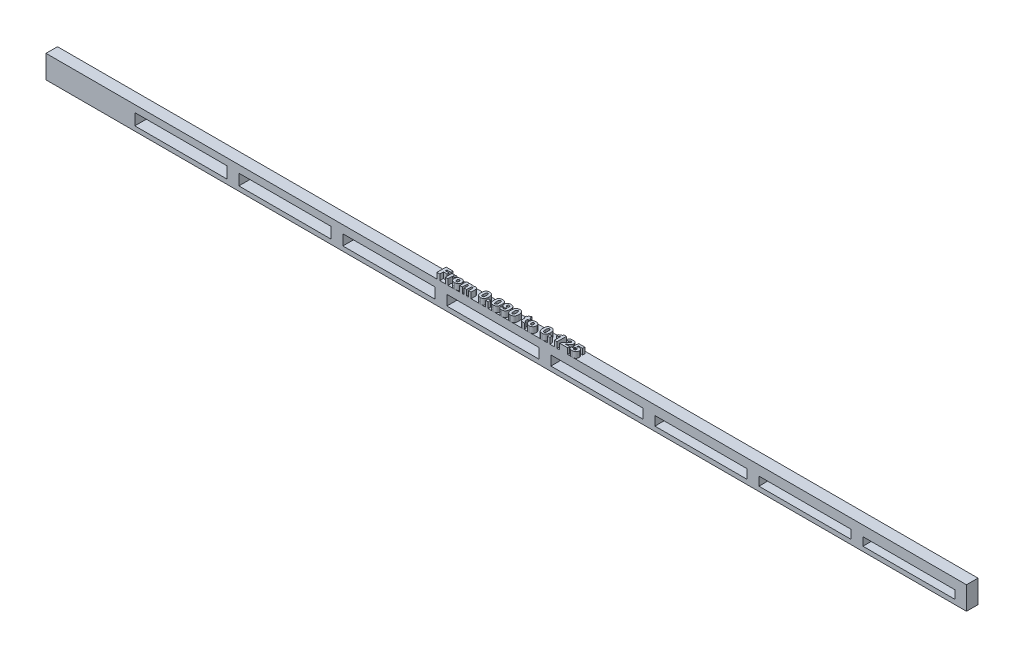
from build123d import *

# Parameters (mm, degrees)
SKETCH1_W               = 254
SKETCH1_H               = 3.175
BOSS_EXTRUDE1_DEPTH     = 3.175
CUT_EXTRUDE1_DEPTH      = 128.049599689
CUT_EXTRUDE1_DEPTH_BACK = 128.049599689
SKETCH2_W               = 25.4
SKETCH2_H               = 2.286
SKETCH2_H_2             = 2.413
SKETCH2_H_3             = 2.54
SKETCH2_H_4             = 2.667
SKETCH2_H_5             = 2.794
SKETCH2_H_6             = 2.921
SKETCH2_H_7             = 3.048
SKETCH2_H_8             = 3.175
SKETCH4_W               = 0.692727273
SKETCH4_H               = 0.725714286
SKETCH4_W_2             = 0.692727272
BOSS_EXTRUDE2_DEPTH     = 1.5875


with BuildPart() as part:
    # Sketch1 → Boss-Extrude1 (new, symmetric)
    with BuildSketch(Plane(origin=(0, 0, 0), x_dir=(1, 0, 0), z_dir=(0, 1, 0))):
        Rectangle(SKETCH1_W, SKETCH1_H)
    extrude(amount=BOSS_EXTRUDE1_DEPTH, both=True)

    # Sketch2 → Cut-Extrude1 (cut, two sides: drawn at the far end of the back side and taken through both)
    with BuildSketch(Plane.XY.offset(-CUT_EXTRUDE1_DEPTH_BACK)):
        with Locations((111.125, -0.762)):
            Rectangle(SKETCH2_W, SKETCH2_H)
        with Locations((82.423, -0.6985)):
            Rectangle(SKETCH2_W, SKETCH2_H_2)
        with Locations((53.721, -0.635)):
            Rectangle(SKETCH2_W, SKETCH2_H_3)
        with Locations((25.019, -0.5715)):
            Rectangle(SKETCH2_W, SKETCH2_H_4)
        with Locations((-3.683, -0.508)):
            Rectangle(SKETCH2_W, SKETCH2_H_5)
        with Locations((-32.385, -0.4445)):
            Rectangle(SKETCH2_W, SKETCH2_H_6)
        with Locations((-61.087, -0.381)):
            Rectangle(SKETCH2_W, SKETCH2_H_7)
        with Locations((-89.789, -0.3175)):
            Rectangle(SKETCH2_W, SKETCH2_H_8)
    extrude(amount=CUT_EXTRUDE1_DEPTH + CUT_EXTRUDE1_DEPTH_BACK, mode=Mode.SUBTRACT)

    # Sketch4 → Boss-Extrude2 (add)
    # profile 1 of 16: a face of its own
    with BuildSketch(Plane(origin=(0, 3.175, 0), x_dir=(1, 0, 0), z_dir=(0, 1, 0))):
        Polygon((-19.132467532, 0.9525), (-17.186233766, 0.9525), (-17.186233766, 0.358733766), (-18.340779221, 0.358733766), (-18.340779221, -0.03711039), (-17.351168831, -0.03711039), (-17.351168831, -0.564902597), (-18.340779221, -0.564902597), (-18.340779221, -1.5875), (-19.132467532, -1.5875), align=None)
    # profile 2 of 16: a face of its own
    with BuildSketch(Plane(origin=(0, 3.175, 0), x_dir=(1, 0, 0), z_dir=(0, 1, 0))):
        with BuildLine():
            Line((-16.79038961, 0.259772727), (-16.145081169, 0.259772727))
            Line((-16.145081169, 0.259772727), (-16.145081169, -0.05463474))
            add(Edge.make_bspline(
                [(-16.145081169, -0.05463474), (-16.12930498, -0.02391847), (-16.099631788, 0.033855292), (-16.049844478, 0.110400736), (-15.999464906, 0.17205239), (-15.94659279, 0.218803742), (-15.88953333, 0.252427623), (-15.827772339, 0.276209394), (-15.759661167, 0.290328554), (-15.712366678, 0.291930877), (-15.687901786, 0.29275974)],
                knots=[0, 0, 0, 0, 1.35166072, 2.542317906, 3.569239087, 4.46110162, 5.290794973, 6.149238203, 7.042622341, 8, 8, 8, 8], degree=3))
            add(Edge.make_bspline(
                [(-15.687901786, 0.29275974), (-15.660673774, 0.291597887), (-15.604349763, 0.289194472), (-15.518462842, 0.270935025), (-15.428744985, 0.242671158), (-15.369632957, 0.215923974), (-15.338961039, 0.202045455)],
                knots=[0, 0, 0, 0, 0.898698919, 1.859053428, 2.889110375, 4, 4, 4, 4], degree=3))
            Line((-15.338961039, 0.202045455), (-15.562654221, -0.319561688))
            add(Edge.make_bspline(
                [(-15.562654221, -0.319561688), (-15.582823406, -0.311692966), (-15.620372764, -0.297043615), (-15.674483079, -0.281027874), (-15.721829067, -0.270138693), (-15.751596179, -0.268684703), (-15.765215097, -0.268019481)],
                knots=[0, 0, 0, 0, 1.235800154, 2.300712817, 3.222549552, 4, 4, 4, 4], degree=3))
            add(Edge.make_bspline(
                [(-15.765215097, -0.268019481), (-15.776758408, -0.268194969), (-15.799309057, -0.268537799), (-15.832048722, -0.274788277), (-15.863028504, -0.283087494), (-15.891860651, -0.295869113), (-15.918580075, -0.311707243), (-15.943375539, -0.331263885), (-15.965962004, -0.3544004), (-15.979133269, -0.371978579), (-15.985815747, -0.380896916)],
                knots=[0, 0, 0, 0, 1.069869519, 2.090063467, 3.084873279, 4.042139314, 5.007874552, 5.962078605, 6.966055018, 8, 8, 8, 8], degree=3))
            add(Edge.make_bspline(
                [(-15.985815747, -0.380896916), (-15.994997652, -0.395448263), (-16.014465245, -0.426300214), (-16.036389021, -0.480087189), (-16.055305747, -0.541890836), (-16.071339022, -0.612133552), (-16.082627333, -0.691290805), (-16.091229149, -0.778997275), (-16.097153809, -0.875278715), (-16.097488343, -0.942353869), (-16.097662338, -0.97724026)],
                knots=[0, 0, 0, 0, 0.671034836, 1.422736572, 2.259101761, 3.195257621, 4.23363245, 5.380253285, 6.637446141, 8, 8, 8, 8], degree=3))
            Line((-16.097662338, -0.97724026), (-16.097662338, -1.5875))
            Line((-16.097662338, -1.5875), (-16.79038961, -1.5875))
            Line((-16.79038961, -1.5875), (-16.79038961, 0.259772727))
        make_face()
    # profile 3 of 16: a face of its own
    with BuildSketch(Plane(origin=(0, 3.175, 0), x_dir=(1, 0, 0), z_dir=(0, 1, 0))):
        with BuildLine():
            add(Edge.make_bspline(
                [(-15.305974026, -0.669017857), (-15.305021789, -0.6347903), (-15.303153481, -0.567635145), (-15.290292007, -0.469326572), (-15.268078134, -0.37567152), (-15.236382066, -0.286867395), (-15.196626545, -0.202267106), (-15.147888335, -0.122298604), (-15.089701552, -0.047378923), (-15.023275793, 0.022587373), (-14.949510161, 0.08640047), (-14.86859394, 0.141873969), (-14.781356285, 0.188401071), (-14.688076856, 0.226583897), (-14.588699998, 0.256642101), (-14.483020432, 0.277347348), (-14.371340917, 0.29069709), (-14.294755792, 0.292061272), (-14.255543831, 0.29275974)],
                knots=[0, 0, 0, 0, 1.025367878, 2.01179234, 2.964384229, 3.903756315, 4.831677839, 5.760369979, 6.703457794, 7.668319946, 8.646477251, 9.620195798, 10.601220098, 11.602983095, 12.635381089, 13.706436241, 14.825684064, 16, 16, 16, 16], degree=3))
            add(Edge.make_bspline(
                [(-14.255543831, 0.29275974), (-14.210827616, 0.291803893), (-14.124053473, 0.28994902), (-13.998168308, 0.274673811), (-13.880625129, 0.250488068), (-13.771639737, 0.215223461), (-13.670925435, 0.170316577), (-13.578486408, 0.115495441), (-13.494426546, 0.050319858), (-13.445893862, -0.000725394), (-13.421590909, -0.026286526)],
                knots=[0, 0, 0, 0, 1.164847763, 2.260447685, 3.299169199, 4.287372507, 5.239221539, 6.166701836, 7.081967966, 8, 8, 8, 8], degree=3))
            add(Edge.make_bspline(
                [(-13.421590909, -0.026286526), (-13.403495126, -0.047967164), (-13.367528873, -0.091058493), (-13.32085543, -0.160961167), (-13.282340198, -0.235183213), (-13.250044014, -0.312680386), (-13.225507001, -0.394086936), (-13.207180673, -0.478825843), (-13.196955512, -0.567571709), (-13.195531387, -0.627930926), (-13.194805195, -0.658709416)],
                knots=[0, 0, 0, 0, 0.985651527, 1.959030615, 2.927758168, 3.901488459, 4.886409414, 5.892444673, 6.925311305, 8, 8, 8, 8], degree=3))
            add(Edge.make_bspline(
                [(-13.194805195, -0.658709416), (-13.195759925, -0.693107287), (-13.197633269, -0.760601833), (-13.21048354, -0.859607137), (-13.232816107, -0.953598191), (-13.263225396, -1.043248142), (-13.303058984, -1.127904065), (-13.351725267, -1.207805949), (-13.409685129, -1.28243277), (-13.475274136, -1.352355552), (-13.548766301, -1.415840949), (-13.629882482, -1.470663625), (-13.717377688, -1.517375663), (-13.811876938, -1.554901833), (-13.91285538, -1.584299546), (-14.020674607, -1.605192854), (-14.13512177, -1.61839687), (-14.213757392, -1.619779487), (-14.253997565, -1.620487013)],
                knots=[0, 0, 0, 0, 1.023611307, 2.008501631, 2.964665315, 3.894380799, 4.820716, 5.743191072, 6.672794078, 7.627685603, 8.592084191, 9.556401456, 10.535368234, 11.537975655, 12.576709016, 13.660652136, 14.802886534, 16, 16, 16, 16], degree=3))
            add(Edge.make_bspline(
                [(-14.253997565, -1.620487013), (-14.290102107, -1.619784694), (-14.36057327, -1.618413863), (-14.463622325, -1.608005084), (-14.561405233, -1.590687349), (-14.65391149, -1.565772399), (-14.741451093, -1.534660857), (-14.823166676, -1.495509691), (-14.900313006, -1.450486731), (-14.947086887, -1.414327454), (-14.970434253, -1.396278409)],
                knots=[0, 0, 0, 0, 1.131304427, 2.208152599, 3.242096183, 4.239912981, 5.2072978, 6.148974209, 7.076053227, 8, 8, 8, 8], degree=3))
            add(Edge.make_bspline(
                [(-14.970434253, -1.396278409), (-14.997291258, -1.372812281), (-15.050024132, -1.326737288), (-15.118379834, -1.248413121), (-15.176602548, -1.16526459), (-15.223726733, -1.076359179), (-15.26068596, -0.982315156), (-15.286777492, -0.882678711), (-15.303301675, -0.777636139), (-15.305072131, -0.705675581), (-15.305974026, -0.669017857)],
                knots=[0, 0, 0, 0, 1.031322573, 2.024968999, 3.000290323, 3.963582072, 4.930461322, 5.918379336, 6.939593082, 8, 8, 8, 8], degree=3))
        make_face()
        with BuildLine():
            add(Edge.make_bspline(
                [(-14.58025974, -0.662832792), (-14.579913859, -0.681907529), (-14.579243069, -0.718900344), (-14.57549349, -0.772516846), (-14.567576315, -0.822059208), (-14.557327339, -0.867713608), (-14.544584525, -0.909729098), (-14.528739364, -0.948013182), (-14.509499996, -0.98241314), (-14.48743457, -1.012812195), (-14.46279235, -1.039145358), (-14.437310116, -1.062617929), (-14.409410491, -1.081898783), (-14.380325082, -1.097644658), (-14.349868851, -1.11054362), (-14.317730378, -1.118920845), (-14.28412952, -1.125129644), (-14.261071882, -1.125495809), (-14.249358766, -1.125681818)],
                knots=[0, 0, 0, 0, 1.428609431, 2.770590601, 4.020679715, 5.181729539, 6.272354871, 7.30457834, 8.278041947, 9.217323036, 10.109609928, 10.975058501, 11.806661778, 12.641443675, 13.449013504, 14.276126181, 15.124284323, 16, 16, 16, 16], degree=3))
            add(Edge.make_bspline(
                [(-14.249358766, -1.125681818), (-14.237641588, -1.12551074), (-14.214575955, -1.125173967), (-14.181076646, -1.118760131), (-14.148613439, -1.111139202), (-14.118306092, -1.098209716), (-14.08891077, -1.083154518), (-14.062444758, -1.062778806), (-14.036030718, -1.040982778), (-14.012563734, -1.014280215), (-13.990460671, -0.984214532), (-13.97169807, -0.949633504), (-13.955447289, -0.911011916), (-13.942948865, -0.86803922), (-13.932534144, -0.821068082), (-13.925455788, -0.769708329), (-13.9214893, -0.714266883), (-13.920849196, -0.675896673), (-13.920519481, -0.656132305)],
                knots=[0, 0, 0, 0, 0.867200774, 1.707111964, 2.522905829, 3.334410474, 4.143812124, 4.964367472, 5.804568504, 6.679595485, 7.591947666, 8.567079176, 9.589265959, 10.69366012, 11.880722071, 13.154586916, 14.534337178, 16, 16, 16, 16], degree=3))
            add(Edge.make_bspline(
                [(-13.920519481, -0.656132305), (-13.920838687, -0.637569525), (-13.921454286, -0.601770722), (-13.925538542, -0.549766746), (-13.932547562, -0.501495666), (-13.942906858, -0.456668218), (-13.956198243, -0.415630791), (-13.972112727, -0.378009029), (-13.991327039, -0.344419242), (-14.012953973, -0.314202995), (-14.037271244, -0.288197029), (-14.062722998, -0.265138353), (-14.089487919, -0.245625676), (-14.117549859, -0.229047476), (-14.147685815, -0.217576512), (-14.178877653, -0.208717283), (-14.211327933, -0.202650181), (-14.233525285, -0.202248189), (-14.244719968, -0.202045455)],
                knots=[0, 0, 0, 0, 1.421292534, 2.740999613, 3.991213148, 5.15273704, 6.259325519, 7.290549907, 8.274455577, 9.216488845, 10.128845765, 10.995182925, 11.84243298, 12.661539028, 13.482333521, 14.302706228, 15.144012034, 16, 16, 16, 16], degree=3))
            add(Edge.make_bspline(
                [(-14.244719968, -0.202045455), (-14.256603545, -0.202233761), (-14.27999994, -0.202604498), (-14.314127211, -0.208782466), (-14.346883494, -0.217310518), (-14.378025048, -0.229823909), (-14.407567406, -0.245944534), (-14.435559818, -0.265498292), (-14.461424231, -0.289261205), (-14.486248507, -0.31575527), (-14.508513611, -0.346324858), (-14.527488973, -0.380744435), (-14.544221757, -0.41858898), (-14.557295232, -0.460306199), (-14.567764183, -0.505613741), (-14.574621135, -0.554775441), (-14.579469525, -0.607586539), (-14.579991707, -0.644093787), (-14.58025974, -0.662832792)],
                knots=[0, 0, 0, 0, 0.886888801, 1.746107121, 2.584046903, 3.413878996, 4.247082387, 5.094999159, 5.958811239, 6.867556463, 7.805061448, 8.776684314, 9.800211562, 10.892630619, 12.038966522, 13.272068494, 14.599765066, 16, 16, 16, 16], degree=3))
        make_face(mode=Mode.SUBTRACT)
    # profile 4 of 16: a face of its own
    with BuildSketch(Plane(origin=(0, 3.175, 0), x_dir=(1, 0, 0), z_dir=(0, 1, 0))):
        with BuildLine():
            Line((-12.831948052, 0.259772727), (-12.18663961, 0.259772727))
            Line((-12.18663961, 0.259772727), (-12.18663961, -0.023709416))
            add(Edge.make_bspline(
                [(-12.18663961, -0.023709416), (-12.163009377, 0.0031445), (-12.117610192, 0.05473713), (-12.045435554, 0.122777366), (-11.972428666, 0.17813553), (-11.897673949, 0.221513662), (-11.818770091, 0.254484496), (-11.733397799, 0.276630522), (-11.640558264, 0.290263698), (-11.576258143, 0.291906762), (-11.542877435, 0.29275974)],
                knots=[0, 0, 0, 0, 1.151069716, 2.211473122, 3.187083284, 4.093977652, 4.986542207, 5.930991535, 6.925896761, 8, 8, 8, 8], degree=3))
            add(Edge.make_bspline(
                [(-11.542877435, 0.29275974), (-11.507592735, 0.291858061), (-11.440624598, 0.29014673), (-11.345929915, 0.275095918), (-11.262293238, 0.251176849), (-11.190026255, 0.215106635), (-11.12661215, 0.169565066), (-11.070415459, 0.114361287), (-11.019627784, 0.049795101), (-10.99212588, 0.00126278), (-10.977974838, -0.023709416)],
                knots=[0, 0, 0, 0, 1.231298935, 2.33692777, 3.339064035, 4.256628334, 5.142318753, 6.054454096, 6.99892375, 8, 8, 8, 8], degree=3))
            add(Edge.make_bspline(
                [(-10.977974838, -0.023709416), (-10.964381229, -0.008788144), (-10.937939144, 0.02023649), (-10.896792103, 0.06023384), (-10.857530781, 0.097502425), (-10.818682761, 0.130528108), (-10.781057429, 0.159973393), (-10.744630566, 0.185958055), (-10.708635094, 0.207681647), (-10.661627576, 0.232945263), (-10.598502871, 0.257049094), (-10.517004319, 0.27840785), (-10.427180861, 0.290582364), (-10.364658903, 0.292014901), (-10.332150974, 0.29275974)],
                knots=[0, 0, 0, 0, 0.973128028, 1.89291415, 2.76630582, 3.583168134, 4.35050561, 5.069967607, 5.739210313, 6.376672227, 7.64132514, 8.985695158, 10.432729716, 12, 12, 12, 12], degree=3))
            add(Edge.make_bspline(
                [(-10.332150974, 0.29275974), (-10.30790259, 0.29232704), (-10.260631173, 0.291483506), (-10.191774294, 0.283126988), (-10.127120674, 0.269175208), (-10.066360901, 0.250278364), (-10.009710751, 0.225282445), (-9.957099984, 0.194958319), (-9.908630421, 0.15903234), (-9.864605005, 0.117597903), (-9.825064163, 0.0703672), (-9.790782566, 0.016677366), (-9.762234053, -0.043359257), (-9.738242302, -0.109216587), (-9.720727984, -0.181384166), (-9.707086723, -0.259505048), (-9.699613291, -0.343984353), (-9.698668603, -0.402359329), (-9.698181818, -0.432439123)],
                knots=[0, 0, 0, 0, 1.056745158, 2.060089482, 3.017923513, 3.937021708, 4.829079389, 5.71165355, 6.579000101, 7.453272005, 8.341295772, 9.257551341, 10.222329884, 11.234026275, 12.307624806, 13.45524866, 14.688725831, 16, 16, 16, 16], degree=3))
            Line((-9.698181818, -0.432439123), (-9.698181818, -1.5875))
            Line((-9.698181818, -1.5875), (-10.390909091, -1.5875))
            Line((-10.390909091, -1.5875), (-10.390909091, -0.546862825))
            add(Edge.make_bspline(
                [(-10.390909091, -0.546862825), (-10.391349105, -0.527387848), (-10.392173465, -0.49090169), (-10.402101589, -0.440390494), (-10.417366271, -0.397109458), (-10.434012808, -0.373902637), (-10.441935877, -0.362857143)],
                knots=[0, 0, 0, 0, 1.199025671, 2.246361527, 3.165340035, 4, 4, 4, 4], degree=3))
            add(Edge.make_bspline(
                [(-10.441935877, -0.362857143), (-10.45454185, -0.348260238), (-10.478691695, -0.320296276), (-10.524367423, -0.290144549), (-10.574277362, -0.270861789), (-10.609616234, -0.268974115), (-10.627487825, -0.268019481)],
                knots=[0, 0, 0, 0, 1.06708877, 2.044271123, 3.01094785, 4, 4, 4, 4], degree=3))
            add(Edge.make_bspline(
                [(-10.627487825, -0.268019481), (-10.648390089, -0.269055576), (-10.688670728, -0.271052231), (-10.746266842, -0.288041947), (-10.79691249, -0.317056312), (-10.833729196, -0.349827682), (-10.858039547, -0.382027407), (-10.874770481, -0.409269559), (-10.888107961, -0.440457382), (-10.899342855, -0.474768174), (-10.908069157, -0.512555085), (-10.913982214, -0.553594393), (-10.918469949, -0.597963784), (-10.9186223, -0.628802207), (-10.918701299, -0.644793019)],
                knots=[0, 0, 0, 0, 1.389503028, 2.677703584, 3.952944765, 5.248434787, 5.925500636, 6.633538212, 7.370893687, 8.177378376, 9.034569696, 9.948403771, 10.936174861, 12, 12, 12, 12], degree=3))
            Line((-10.918701299, -0.644793019), (-10.918701299, -1.5875))
            Line((-10.918701299, -1.5875), (-11.611428571, -1.5875))
            Line((-11.611428571, -1.5875), (-11.611428571, -0.583973214))
            add(Edge.make_bspline(
                [(-11.611428571, -0.583973214), (-11.611638765, -0.565584387), (-11.612024039, -0.531878738), (-11.61437651, -0.486120659), (-11.618363112, -0.449795331), (-11.623620431, -0.42931175), (-11.62586039, -0.420584416)],
                knots=[0, 0, 0, 0, 1.341389009, 2.458687966, 3.343301102, 4, 4, 4, 4], degree=3))
            add(Edge.make_bspline(
                [(-11.62586039, -0.420584416), (-11.630349576, -0.409603103), (-11.639228621, -0.387883446), (-11.658059229, -0.358305363), (-11.681148694, -0.332008067), (-11.708411013, -0.309608788), (-11.738793106, -0.290852552), (-11.77217616, -0.277253319), (-11.808301618, -0.269427773), (-11.833193759, -0.268496538), (-11.845945617, -0.268019481)],
                knots=[0, 0, 0, 0, 0.994077925, 1.96616119, 2.926517273, 3.919758256, 4.91634279, 5.912405635, 6.930557731, 8, 8, 8, 8], degree=3))
            add(Edge.make_bspline(
                [(-11.845945617, -0.268019481), (-11.866504107, -0.269050399), (-11.906489469, -0.27105549), (-11.963691328, -0.28842831), (-12.013994367, -0.318594439), (-12.051639793, -0.351216642), (-12.076455009, -0.384107426), (-12.094030749, -0.412044545), (-12.107395939, -0.444483985), (-12.119632553, -0.479972656), (-12.127844063, -0.519506748), (-12.134897096, -0.562274989), (-12.138094795, -0.608839491), (-12.13883651, -0.641011038), (-12.139220779, -0.657678571)],
                knots=[0, 0, 0, 0, 1.337188597, 2.600773213, 3.844333349, 5.13594442, 5.814067638, 6.52217549, 7.278831961, 8.092647515, 8.964039484, 9.90406356, 10.914130854, 12, 12, 12, 12], degree=3))
            Line((-12.139220779, -0.657678571), (-12.139220779, -1.5875))
            Line((-12.139220779, -1.5875), (-12.831948052, -1.5875))
            Line((-12.831948052, -1.5875), (-12.831948052, 0.259772727))
        make_face()
    # profile 5 of 16: a face of its own
    with BuildSketch(Plane(origin=(0, 3.175, 0), x_dir=(1, 0, 0), z_dir=(0, 1, 0))):
        with BuildLine():
            add(Edge.make_bspline(
                [(-8.180779221, -0.307191558), (-8.180590211, -0.277809652), (-8.180219821, -0.220231683), (-8.177051876, -0.135501373), (-8.171960993, -0.054031125), (-8.164802727, 0.024181701), (-8.155603468, 0.098971805), (-8.144185173, 0.170299556), (-8.131114914, 0.238332082), (-8.114883095, 0.302680942), (-8.09737337, 0.363943093), (-8.078104231, 0.42186203), (-8.056269642, 0.476352993), (-8.032531288, 0.527451692), (-8.007019856, 0.575596765), (-7.978498428, 0.619751486), (-7.948535182, 0.66085371), (-7.905839287, 0.711073309), (-7.846385304, 0.76768454), (-7.766365931, 0.826433696), (-7.67720877, 0.875358191), (-7.580038875, 0.916218211), (-7.474072337, 0.947629338), (-7.359580242, 0.969338309), (-7.236509333, 0.982943478), (-7.151518529, 0.984621365), (-7.107670455, 0.985487013)],
                knots=[0, 0, 0, 0, 1.087591881, 2.13128891, 3.138140209, 4.108914138, 5.038156313, 5.926884649, 6.782501702, 7.601552758, 8.382534381, 9.140733058, 9.859947563, 10.554209912, 11.225728598, 11.87495301, 12.498241101, 13.107351257, 14.312855526, 15.527634648, 16.771709977, 18.068615969, 19.42276522, 20.854627635, 22.377253613, 24, 24, 24, 24], degree=3))
            add(Edge.make_bspline(
                [(-7.107670455, 0.985487013), (-7.066072039, 0.98465054), (-6.986659961, 0.983053699), (-6.87324427, 0.972341714), (-6.771645934, 0.952224729), (-6.681049719, 0.924902875), (-6.600341779, 0.890949948), (-6.527859422, 0.852292283), (-6.462884209, 0.809015029), (-6.406056449, 0.760698409), (-6.35632801, 0.709436438), (-6.311638699, 0.657159805), (-6.272317984, 0.603807352), (-6.238805594, 0.548099667), (-6.209829668, 0.489478087), (-6.183326137, 0.427176307), (-6.160832558, 0.359818565), (-6.148230098, 0.313101278), (-6.141769481, 0.289151786)],
                knots=[0, 0, 0, 0, 1.532758214, 2.92606128, 4.191114603, 5.342542327, 6.406514669, 7.411909621, 8.365259272, 9.277101494, 10.154475564, 10.994207034, 11.809606612, 12.593434151, 13.38610729, 14.217325278, 15.086116559, 16, 16, 16, 16], degree=3))
            add(Edge.make_bspline(
                [(-6.141769481, 0.289151786), (-6.130661242, 0.241859161), (-6.108336637, 0.146813566), (-6.086130831, 0.001078331), (-6.072340851, -0.147656827), (-6.070525695, -0.247887398), (-6.06961039, -0.298429383)],
                knots=[0, 0, 0, 0, 0.98198754, 1.973533715, 2.978139842, 4, 4, 4, 4], degree=3))
            add(Edge.make_bspline(
                [(-6.06961039, -0.298429383), (-6.070198897, -0.35377351), (-6.071335223, -0.460635363), (-6.082936284, -0.615136832), (-6.101054686, -0.758041082), (-6.126616099, -0.889720102), (-6.159666666, -1.010065641), (-6.200955325, -1.118958799), (-6.249198276, -1.216473518), (-6.305345742, -1.303150133), (-6.370934589, -1.378977883), (-6.447344975, -1.444330064), (-6.534776837, -1.498893653), (-6.632552065, -1.544069626), (-6.741235504, -1.57827134), (-6.860236824, -1.602611984), (-6.989939998, -1.617732343), (-7.079965975, -1.619545135), (-7.126741071, -1.620487013)],
                knots=[0, 0, 0, 0, 1.355222045, 2.616746286, 3.792100794, 4.881385083, 5.899230633, 6.844809326, 7.729242134, 8.559026746, 9.367323913, 10.17605905, 11.01191325, 11.883571865, 12.807079121, 13.795717036, 14.854713345, 16, 16, 16, 16], degree=3))
            add(Edge.make_bspline(
                [(-7.126741071, -1.620487013), (-7.153204465, -1.620186324), (-7.204970869, -1.619598131), (-7.280861658, -1.615116979), (-7.352692059, -1.606655367), (-7.420773539, -1.596199889), (-7.484746754, -1.581602219), (-7.545058384, -1.564259818), (-7.60143858, -1.543700045), (-7.670759442, -1.512064132), (-7.751113873, -1.464530635), (-7.838188292, -1.395113897), (-7.917524457, -1.314825777), (-7.961184815, -1.252979814), (-7.983372565, -1.221550325)],
                knots=[0, 0, 0, 0, 0.962031703, 1.881879664, 2.761979937, 3.590622586, 4.384597812, 5.1455833, 5.870765821, 6.563934203, 7.913599601, 9.251901546, 10.603444349, 12, 12, 12, 12], degree=3))
            add(Edge.make_bspline(
                [(-7.983372565, -1.221550325), (-7.998565882, -1.196608358), (-8.030666127, -1.143911293), (-8.068800392, -1.054263621), (-8.102200031, -0.952261444), (-8.130669225, -0.838762016), (-8.152752487, -0.715409914), (-8.169260697, -0.584851808), (-8.179197505, -0.4480574), (-8.180244661, -0.354798908), (-8.180779221, -0.307191558)],
                knots=[0, 0, 0, 0, 0.739508101, 1.562423156, 2.461722298, 3.458822943, 4.525732562, 5.636331831, 6.793375565, 8, 8, 8, 8], degree=3))
        make_face()
        with BuildLine():
            add(Edge.make_bspline(
                [(-7.488051948, -0.31492289), (-7.487731821, -0.352380606), (-7.487117792, -0.424227424), (-7.483139377, -0.527376845), (-7.47615918, -0.621283939), (-7.465846001, -0.705875548), (-7.453330992, -0.781522518), (-7.437509995, -0.847832501), (-7.41941931, -0.905212127), (-7.397378925, -0.9534329), (-7.372985209, -0.994571193), (-7.345342653, -1.029155784), (-7.315837532, -1.059247165), (-7.283283216, -1.083474001), (-7.248062358, -1.102533509), (-7.21028031, -1.115686803), (-7.169923058, -1.124491238), (-7.142080748, -1.125277658), (-7.127771916, -1.125681818)],
                knots=[0, 0, 0, 0, 1.821909252, 3.494563902, 5.019956466, 6.400590685, 7.638410235, 8.747100251, 9.714301165, 10.559433052, 11.320433586, 12.034323191, 12.707949409, 13.364779561, 14.000375056, 14.647943435, 15.305145593, 16, 16, 16, 16], degree=3))
            add(Edge.make_bspline(
                [(-7.127771916, -1.125681818), (-7.109137351, -1.124781895), (-7.07257002, -1.12301594), (-7.019672749, -1.109316652), (-6.970822538, -1.086094802), (-6.925888754, -1.053688605), (-6.885645669, -1.011215679), (-6.85158087, -0.957875665), (-6.822847108, -0.894562224), (-6.804473627, -0.834092936), (-6.79263393, -0.779336497), (-6.784446675, -0.731695978), (-6.777241508, -0.678764128), (-6.771636026, -0.620303657), (-6.767711943, -0.556345339), (-6.764685513, -0.486923818), (-6.762459008, -0.412008218), (-6.76237908, -0.360281809), (-6.762337662, -0.333478084)],
                knots=[0, 0, 0, 0, 0.916415337, 1.79831749, 2.668301498, 3.564798814, 4.509831996, 5.530070663, 6.665194469, 7.922271743, 8.632174375, 9.421805176, 10.300783619, 11.260830182, 12.3115562, 13.454245384, 14.680834273, 16, 16, 16, 16], degree=3))
            add(Edge.make_bspline(
                [(-6.762337662, -0.333478084), (-6.762658705, -0.294474313), (-6.76327411, -0.219708101), (-6.767227106, -0.112607903), (-6.774223012, -0.015439453), (-6.784496104, 0.071561802), (-6.796947045, 0.148770474), (-6.812905652, 0.215919721), (-6.830850059, 0.273496866), (-6.852700618, 0.321684829), (-6.878381645, 0.361551811), (-6.905316424, 0.396621729), (-6.936201358, 0.425576156), (-6.96933825, 0.449928461), (-7.006160432, 0.467858903), (-7.045354788, 0.481499072), (-7.087779905, 0.489281781), (-7.116917082, 0.490206473), (-7.131895292, 0.490681818)],
                knots=[0, 0, 0, 0, 1.854070858, 3.554062822, 5.093710173, 6.483564629, 7.717457497, 8.808936618, 9.761959363, 10.58049486, 11.31461684, 12.012310019, 12.676654168, 13.320346403, 13.959515242, 14.615524135, 15.288298562, 16, 16, 16, 16], degree=3))
            add(Edge.make_bspline(
                [(-7.131895292, 0.490681818), (-7.14705534, 0.490261153), (-7.176585021, 0.489441755), (-7.219085089, 0.480946771), (-7.258301974, 0.467474555), (-7.294471077, 0.448803516), (-7.327066634, 0.424139942), (-7.35692013, 0.394572381), (-7.382512626, 0.358924268), (-7.405765704, 0.317978536), (-7.42524862, 0.269568229), (-7.442190806, 0.212801422), (-7.456137079, 0.147079428), (-7.468004717, 0.072246384), (-7.476945708, -0.011539284), (-7.483727176, -0.104532277), (-7.486951001, -0.20666195), (-7.487674543, -0.277811015), (-7.488051948, -0.31492289)],
                knots=[0, 0, 0, 0, 0.737997139, 1.437516644, 2.102141925, 2.753771676, 3.411878008, 4.086813041, 4.793511383, 5.543335322, 6.376757621, 7.330304624, 8.427368638, 9.648338126, 11.021405169, 12.532439492, 14.191294945, 16, 16, 16, 16], degree=3))
        make_face(mode=Mode.SUBTRACT)
    # profile 6 of 16: a face of its own
    with BuildSketch(Plane(origin=(0, 3.175, 0), x_dir=(1, 0, 0), z_dir=(0, 1, 0))):
        with Locations((-5.360389611, -1.224642857)):
            Rectangle(SKETCH4_W, SKETCH4_H)
    # profile 7 of 16: a face of its own
    with BuildSketch(Plane(origin=(0, 3.175, 0), x_dir=(1, 0, 0), z_dir=(0, 1, 0))):
        with BuildLine():
            add(Edge.make_bspline(
                [(-4.618181818, -0.307191558), (-4.617992809, -0.277809652), (-4.617622418, -0.220231683), (-4.614454473, -0.135501373), (-4.609363591, -0.054031125), (-4.602205325, 0.024181701), (-4.593006065, 0.098971805), (-4.58158777, 0.170299556), (-4.568517511, 0.238332082), (-4.552285692, 0.302680942), (-4.534775968, 0.363943093), (-4.515506829, 0.42186203), (-4.49367224, 0.476352993), (-4.469933885, 0.527451692), (-4.444422453, 0.575596765), (-4.415901025, 0.619751486), (-4.385937779, 0.66085371), (-4.343241884, 0.711073309), (-4.283787902, 0.76768454), (-4.203768529, 0.826433696), (-4.114611367, 0.875358191), (-4.017441472, 0.916218211), (-3.911474935, 0.947629338), (-3.796982839, 0.969338309), (-3.673911931, 0.982943478), (-3.588921126, 0.984621365), (-3.545073052, 0.985487013)],
                knots=[0, 0, 0, 0, 1.087591881, 2.13128891, 3.138140209, 4.108914138, 5.038156313, 5.926884649, 6.782501702, 7.601552758, 8.382534381, 9.140733058, 9.859947563, 10.554209912, 11.225728598, 11.87495301, 12.498241101, 13.107351257, 14.312855526, 15.527634648, 16.771709977, 18.068615969, 19.42276522, 20.854627635, 22.377253613, 24, 24, 24, 24], degree=3))
            add(Edge.make_bspline(
                [(-3.545073052, 0.985487013), (-3.503474636, 0.98465054), (-3.424062559, 0.983053699), (-3.310646867, 0.972341714), (-3.209048531, 0.952224729), (-3.118452316, 0.924902875), (-3.037744377, 0.890949948), (-2.965262019, 0.852292283), (-2.900286806, 0.809015029), (-2.843459046, 0.760698409), (-2.793730607, 0.709436438), (-2.749041296, 0.657159805), (-2.709720581, 0.603807352), (-2.676208191, 0.548099667), (-2.647232265, 0.489478087), (-2.620728734, 0.427176307), (-2.598235156, 0.359818565), (-2.585632695, 0.313101278), (-2.579172078, 0.289151786)],
                knots=[0, 0, 0, 0, 1.532758214, 2.92606128, 4.191114603, 5.342542327, 6.406514669, 7.411909621, 8.365259272, 9.277101494, 10.154475564, 10.994207034, 11.809606612, 12.593434151, 13.38610729, 14.217325278, 15.086116559, 16, 16, 16, 16], degree=3))
            add(Edge.make_bspline(
                [(-2.579172078, 0.289151786), (-2.568063839, 0.241859161), (-2.545739235, 0.146813566), (-2.523533428, 0.001078331), (-2.509743448, -0.147656827), (-2.507928292, -0.247887398), (-2.507012987, -0.298429383)],
                knots=[0, 0, 0, 0, 0.98198754, 1.973533715, 2.978139842, 4, 4, 4, 4], degree=3))
            add(Edge.make_bspline(
                [(-2.507012987, -0.298429383), (-2.507601494, -0.35377351), (-2.50873782, -0.460635363), (-2.520338882, -0.615136832), (-2.538457283, -0.758041082), (-2.564018697, -0.889720102), (-2.597069264, -1.010065641), (-2.638357922, -1.118958799), (-2.686600873, -1.216473518), (-2.74274834, -1.303150133), (-2.808337187, -1.378977883), (-2.884747573, -1.444330064), (-2.972179435, -1.498893653), (-3.069954663, -1.544069626), (-3.178638102, -1.57827134), (-3.297639421, -1.602611984), (-3.427342596, -1.617732343), (-3.517368572, -1.619545135), (-3.564143669, -1.620487013)],
                knots=[0, 0, 0, 0, 1.355222045, 2.616746286, 3.792100794, 4.881385083, 5.899230633, 6.844809326, 7.729242134, 8.559026746, 9.367323913, 10.17605905, 11.01191325, 11.883571865, 12.807079121, 13.795717036, 14.854713345, 16, 16, 16, 16], degree=3))
            add(Edge.make_bspline(
                [(-3.564143669, -1.620487013), (-3.590607062, -1.620186324), (-3.642373466, -1.619598131), (-3.718264255, -1.615116979), (-3.790094657, -1.606655367), (-3.858176137, -1.596199889), (-3.922149351, -1.581602219), (-3.982460981, -1.564259818), (-4.038841177, -1.543700045), (-4.108162039, -1.512064132), (-4.188516471, -1.464530635), (-4.275590889, -1.395113897), (-4.354927054, -1.314825777), (-4.398587413, -1.252979814), (-4.420775162, -1.221550325)],
                knots=[0, 0, 0, 0, 0.962031703, 1.881879664, 2.761979937, 3.590622586, 4.384597812, 5.1455833, 5.870765821, 6.563934203, 7.913599601, 9.251901546, 10.603444349, 12, 12, 12, 12], degree=3))
            add(Edge.make_bspline(
                [(-4.420775162, -1.221550325), (-4.43596848, -1.196608358), (-4.468068724, -1.143911293), (-4.50620299, -1.054263621), (-4.539602628, -0.952261444), (-4.568071823, -0.838762016), (-4.590155085, -0.715409914), (-4.606663294, -0.584851808), (-4.616600103, -0.4480574), (-4.617647258, -0.354798908), (-4.618181818, -0.307191558)],
                knots=[0, 0, 0, 0, 0.739508101, 1.562423156, 2.461722298, 3.458822943, 4.525732562, 5.636331831, 6.793375565, 8, 8, 8, 8], degree=3))
        make_face()
        with BuildLine():
            add(Edge.make_bspline(
                [(-3.925454545, -0.31492289), (-3.925134418, -0.352380606), (-3.924520389, -0.424227424), (-3.920541975, -0.527376845), (-3.913561777, -0.621283939), (-3.903248598, -0.705875548), (-3.890733589, -0.781522518), (-3.874912592, -0.847832501), (-3.856821907, -0.905212127), (-3.834781523, -0.9534329), (-3.810387806, -0.994571193), (-3.782745251, -1.029155784), (-3.753240129, -1.059247165), (-3.720685814, -1.083474001), (-3.685464956, -1.102533509), (-3.647682907, -1.115686803), (-3.607325655, -1.124491238), (-3.579483346, -1.125277658), (-3.565174513, -1.125681818)],
                knots=[0, 0, 0, 0, 1.821909252, 3.494563902, 5.019956466, 6.400590685, 7.638410235, 8.747100251, 9.714301165, 10.559433052, 11.320433586, 12.034323191, 12.707949409, 13.364779561, 14.000375056, 14.647943435, 15.305145593, 16, 16, 16, 16], degree=3))
            add(Edge.make_bspline(
                [(-3.565174513, -1.125681818), (-3.546539948, -1.124781895), (-3.509972617, -1.12301594), (-3.457075347, -1.109316652), (-3.408225136, -1.086094802), (-3.363291352, -1.053688605), (-3.323048267, -1.011215679), (-3.288983467, -0.957875665), (-3.260249706, -0.894562224), (-3.241876224, -0.834092936), (-3.230036527, -0.779336497), (-3.221849273, -0.731695978), (-3.214644105, -0.678764128), (-3.209038623, -0.620303657), (-3.20511454, -0.556345339), (-3.202088111, -0.486923818), (-3.199861605, -0.412008218), (-3.199781677, -0.360281809), (-3.19974026, -0.333478084)],
                knots=[0, 0, 0, 0, 0.916415337, 1.79831749, 2.668301498, 3.564798814, 4.509831996, 5.530070663, 6.665194469, 7.922271743, 8.632174375, 9.421805176, 10.300783619, 11.260830182, 12.3115562, 13.454245384, 14.680834273, 16, 16, 16, 16], degree=3))
            add(Edge.make_bspline(
                [(-3.19974026, -0.333478084), (-3.200061302, -0.294474313), (-3.200676707, -0.219708101), (-3.204629704, -0.112607903), (-3.21162561, -0.015439453), (-3.221898701, 0.071561802), (-3.234349642, 0.148770474), (-3.25030825, 0.215919721), (-3.268252656, 0.273496866), (-3.290103216, 0.321684829), (-3.315784243, 0.361551811), (-3.342719021, 0.396621729), (-3.373603956, 0.425576156), (-3.406740847, 0.449928461), (-3.44356303, 0.467858903), (-3.482757386, 0.481499072), (-3.525182503, 0.489281781), (-3.554319679, 0.490206473), (-3.56929789, 0.490681818)],
                knots=[0, 0, 0, 0, 1.854070858, 3.554062822, 5.093710173, 6.483564629, 7.717457497, 8.808936618, 9.761959363, 10.58049486, 11.31461684, 12.012310019, 12.676654168, 13.320346403, 13.959515242, 14.615524135, 15.288298562, 16, 16, 16, 16], degree=3))
            add(Edge.make_bspline(
                [(-3.56929789, 0.490681818), (-3.584457937, 0.490261153), (-3.613987618, 0.489441755), (-3.656487686, 0.480946771), (-3.695704572, 0.467474555), (-3.731873674, 0.448803516), (-3.764469231, 0.424139942), (-3.794322728, 0.394572381), (-3.819915223, 0.358924268), (-3.843168301, 0.317978536), (-3.862651217, 0.269568229), (-3.879593403, 0.212801422), (-3.893539676, 0.147079428), (-3.905407314, 0.072246384), (-3.914348305, -0.011539284), (-3.921129773, -0.104532277), (-3.924353598, -0.20666195), (-3.92507714, -0.277811015), (-3.925454545, -0.31492289)],
                knots=[0, 0, 0, 0, 0.737997139, 1.437516644, 2.102141925, 2.753771676, 3.411878008, 4.086813041, 4.793511383, 5.543335322, 6.376757621, 7.330304624, 8.427368638, 9.648338126, 11.021405169, 12.532439492, 14.191294945, 16, 16, 16, 16], degree=3))
        make_face(mode=Mode.SUBTRACT)
    # profile 8 of 16: a face of its own
    with BuildSketch(Plane(origin=(0, 3.175, 0), x_dir=(1, 0, 0), z_dir=(0, 1, 0))):
        with BuildLine():
            Line((-2.177142857, -0.948376623), (-1.484415584, -0.861785714))
            add(Edge.make_bspline(
                [(-1.484415584, -0.861785714), (-1.47944687, -0.884264446), (-1.470121363, -0.926453545), (-1.449144017, -0.983645946), (-1.423645456, -1.030601688), (-1.392537382, -1.067092672), (-1.356369393, -1.093181111), (-1.316973714, -1.112143575), (-1.273754962, -1.123841485), (-1.243614399, -1.125060466), (-1.228250812, -1.125681818)],
                knots=[0, 0, 0, 0, 1.362441254, 2.557091245, 3.595946439, 4.512118044, 5.371056947, 6.217669575, 7.091490489, 8, 8, 8, 8], degree=3))
            add(Edge.make_bspline(
                [(-1.228250812, -1.125681818), (-1.214458077, -1.125257766), (-1.187301095, -1.124422835), (-1.147803324, -1.115670216), (-1.110269919, -1.102506474), (-1.075530096, -1.083009174), (-1.043059691, -1.058579748), (-1.013773876, -1.028096922), (-0.986030396, -0.99283964), (-0.970401662, -0.966279944), (-0.962293019, -0.9525)],
                knots=[0, 0, 0, 0, 0.987738822, 1.944792341, 2.888102183, 3.831251037, 4.789969066, 5.792054661, 6.85445359, 8, 8, 8, 8], degree=3))
            add(Edge.make_bspline(
                [(-0.962293019, -0.9525), (-0.95632182, -0.940598179), (-0.943176943, -0.914397753), (-0.928814426, -0.868472523), (-0.913392768, -0.814345815), (-0.900837568, -0.750944423), (-0.887469927, -0.679076471), (-0.876646898, -0.598175935), (-0.866205835, -0.508318498), (-0.86060003, -0.445340791), (-0.857662338, -0.412337662)],
                knots=[0, 0, 0, 0, 0.577116523, 1.270452491, 2.082793772, 3.020320379, 4.073528645, 5.255776453, 6.561904382, 8, 8, 8, 8], degree=3))
            add(Edge.make_bspline(
                [(-0.857662338, -0.412337662), (-0.87860066, -0.435538536), (-0.919182151, -0.48050518), (-0.984105132, -0.540073801), (-1.050359283, -0.589303214), (-1.117761528, -0.629618436), (-1.188698151, -0.659913227), (-1.264112531, -0.68166786), (-1.344797417, -0.694712026), (-1.400353054, -0.69612726), (-1.42875, -0.696850649)],
                knots=[0, 0, 0, 0, 1.134156494, 2.198159063, 3.192379089, 4.126229827, 5.042671825, 5.984239097, 6.969655325, 8, 8, 8, 8], degree=3))
            add(Edge.make_bspline(
                [(-1.42875, -0.696850649), (-1.456787607, -0.696165758), (-1.512046183, -0.694815924), (-1.593245317, -0.68389055), (-1.670912765, -0.665270251), (-1.745158625, -0.639332008), (-1.816110888, -0.606148875), (-1.883871371, -0.565850795), (-1.948225423, -0.517957369), (-2.008533182, -0.463290321), (-2.063276426, -0.402763164), (-2.11183748, -0.338199885), (-2.151874821, -0.269029343), (-2.185892365, -0.196662909), (-2.211758567, -0.119869162), (-2.229296007, -0.039099047), (-2.241327099, 0.045170328), (-2.242513592, 0.102697445), (-2.243116883, 0.131948052)],
                knots=[0, 0, 0, 0, 1.036281715, 2.042380109, 3.022190644, 3.984405389, 4.944857527, 5.913257793, 6.89397377, 7.905730343, 8.917486916, 9.90708945, 10.886426354, 11.866833752, 12.859082667, 13.874580603, 14.919295629, 16, 16, 16, 16], degree=3))
            add(Edge.make_bspline(
                [(-2.243116883, 0.131948052), (-2.24263224, 0.152058088), (-2.241669721, 0.191997404), (-2.236670776, 0.25127202), (-2.227378928, 0.309337027), (-2.213758277, 0.365855762), (-2.197388769, 0.421202797), (-2.177338487, 0.475066058), (-2.152805361, 0.527233913), (-2.12512028, 0.578025228), (-2.094410666, 0.626949493), (-2.060438724, 0.672765389), (-2.023464123, 0.715393566), (-1.983859078, 0.755024195), (-1.94147189, 0.791693659), (-1.896449768, 0.825449689), (-1.8484302, 0.855738582), (-1.797691311, 0.883247292), (-1.743781658, 0.907539169), (-1.686642402, 0.928679941), (-1.625945688, 0.946118324), (-1.562079553, 0.960472299), (-1.494967671, 0.971726691), (-1.424634948, 0.980083982), (-1.350810261, 0.984609334), (-1.300415694, 0.985190001), (-1.274638799, 0.985487013)],
                knots=[0, 0, 0, 0, 0.993313437, 1.972759218, 2.935262716, 3.894319325, 4.841935035, 5.784370396, 6.729589915, 7.686429483, 8.639801684, 9.579942523, 10.50027078, 11.424229383, 12.34455764, 13.266019475, 14.200514925, 15.145848686, 16.114206044, 17.118224803, 18.152025669, 19.230643186, 20.349363817, 21.51126873, 22.727010295, 24, 24, 24, 24], degree=3))
            add(Edge.make_bspline(
                [(-1.274638799, 0.985487013), (-1.24387195, 0.985130565), (-1.183819794, 0.984434833), (-1.096132631, 0.977882036), (-1.012907536, 0.968657004), (-0.934692089, 0.953940529), (-0.860822238, 0.93621637), (-0.792008262, 0.913474678), (-0.727514069, 0.887107574), (-0.667302243, 0.856770149), (-0.611202973, 0.821126226), (-0.557977915, 0.781497001), (-0.507844588, 0.736968115), (-0.460683196, 0.687621232), (-0.416390901, 0.633517363), (-0.37520667, 0.574398791), (-0.336308332, 0.510889417), (-0.300927672, 0.442305388), (-0.268528824, 0.368644843), (-0.241062909, 0.28926303), (-0.217228963, 0.204256359), (-0.19781777, 0.113718093), (-0.182786363, 0.017354566), (-0.173084921, -0.084551698), (-0.165830048, -0.192149066), (-0.165238743, -0.265772563), (-0.164935065, -0.303583604)],
                knots=[0, 0, 0, 0, 1.134339395, 2.214056024, 3.241151419, 4.220351569, 5.146918544, 6.040472541, 6.889927166, 7.714444557, 8.523010522, 9.337758085, 10.159056217, 10.992506937, 11.85238759, 12.734731036, 13.64744035, 14.596710335, 15.578366882, 16.612278624, 17.691400287, 18.832143994, 20.02478586, 21.285600092, 22.605957451, 24, 24, 24, 24], degree=3))
            add(Edge.make_bspline(
                [(-0.164935065, -0.303583604), (-0.165805271, -0.358590271), (-0.167488614, -0.46499617), (-0.180929222, -0.618768225), (-0.202868904, -0.761243266), (-0.233256522, -0.89248593), (-0.273472866, -1.012551991), (-0.322885853, -1.121040977), (-0.380646343, -1.218740869), (-0.448236452, -1.304205897), (-0.523602434, -1.379006945), (-0.606022137, -1.443716118), (-0.695106557, -1.498843015), (-0.791513321, -1.543181606), (-0.894358414, -1.578452319), (-1.004284518, -1.60298786), (-1.120998731, -1.617460208), (-1.201063259, -1.619460231), (-1.242167208, -1.620487013)],
                knots=[0, 0, 0, 0, 1.359489706, 2.629821694, 3.811861865, 4.920216686, 5.95562563, 6.936205618, 7.861884749, 8.753949965, 9.62179002, 10.480700207, 11.33870704, 12.205091196, 13.098166679, 14.021260749, 14.984144426, 16, 16, 16, 16], degree=3))
            add(Edge.make_bspline(
                [(-1.242167208, -1.620487013), (-1.266396141, -1.620332283), (-1.313680229, -1.62003032), (-1.382643176, -1.616438748), (-1.447612339, -1.610169176), (-1.508554187, -1.602168956), (-1.565526656, -1.591359514), (-1.618487567, -1.577951876), (-1.66784389, -1.562632631), (-1.727664413, -1.538751727), (-1.796935004, -1.502676686), (-1.872910401, -1.450553212), (-1.941830105, -1.389451597), (-2.003480337, -1.319378192), (-2.05789176, -1.239885343), (-2.104380641, -1.150966266), (-2.145841409, -1.053591354), (-2.166490985, -0.98418116), (-2.177142857, -0.948376623)],
                knots=[0, 0, 0, 0, 0.92135834, 1.798081213, 2.625065065, 3.403108584, 4.134806567, 4.828897795, 5.479822914, 6.098605077, 7.2763031, 8.441629562, 9.594118374, 10.769948085, 11.982386007, 13.248021843, 14.580420318, 16, 16, 16, 16], degree=3))
        make_face()
        with BuildLine():
            add(Edge.make_bspline(
                [(-0.882918019, 0.136586851), (-0.88321666, 0.149998166), (-0.883800504, 0.176217325), (-0.888314288, 0.214599187), (-0.896779708, 0.250540053), (-0.907386287, 0.284589712), (-0.921908299, 0.316018882), (-0.939626798, 0.345179001), (-0.960374662, 0.372143774), (-0.991772341, 0.40480401), (-1.036396844, 0.439093247), (-1.096561709, 0.46906956), (-1.162357138, 0.487892844), (-1.208365947, 0.489739094), (-1.231858766, 0.490681818)],
                knots=[0, 0, 0, 0, 0.864651423, 1.690395885, 2.48578918, 3.242444062, 3.985930188, 4.711627189, 5.438337969, 6.174776675, 7.628198235, 9.040037738, 10.488596858, 12, 12, 12, 12], degree=3))
            add(Edge.make_bspline(
                [(-1.231858766, 0.490681818), (-1.253780631, 0.489800189), (-1.296364338, 0.488087606), (-1.357403982, 0.471612131), (-1.412356118, 0.444238254), (-1.453280617, 0.413430502), (-1.481318376, 0.383242008), (-1.500075076, 0.35795513), (-1.515444739, 0.329731148), (-1.528641973, 0.299124113), (-1.537997057, 0.265596154), (-1.545505464, 0.22964813), (-1.549400444, 0.190962845), (-1.550053406, 0.16425493), (-1.55038961, 0.150503247)],
                knots=[0, 0, 0, 0, 1.493697685, 2.90154085, 4.27538124, 5.66370525, 6.368870792, 7.08179203, 7.806096242, 8.557418578, 9.351442987, 10.176960492, 11.061332106, 12, 12, 12, 12], degree=3))
            add(Edge.make_bspline(
                [(-1.55038961, 0.150503247), (-1.550053544, 0.136580024), (-1.549404754, 0.109700678), (-1.545519744, 0.070467911), (-1.537599613, 0.033978312), (-1.527353199, -0.000187432), (-1.514579985, -0.031969923), (-1.498300842, -0.061076949), (-1.479481072, -0.088041249), (-1.449678947, -0.119250151), (-1.408072488, -0.15278902), (-1.350915394, -0.181282509), (-1.288068703, -0.199134759), (-1.244180452, -0.201055211), (-1.221550325, -0.202045455)],
                knots=[0, 0, 0, 0, 0.921416337, 1.778831561, 2.603755014, 3.387715452, 4.137123037, 4.86474568, 5.590234006, 6.306039158, 7.713893064, 9.101779023, 10.505588421, 12, 12, 12, 12], degree=3))
            add(Edge.make_bspline(
                [(-1.221550325, -0.202045455), (-1.19824621, -0.20101005), (-1.153075131, -0.199003093), (-1.088412468, -0.181872395), (-1.029761777, -0.154505079), (-0.986813763, -0.122227389), (-0.956569667, -0.091747521), (-0.937155029, -0.065632885), (-0.919786363, -0.037970089), (-0.906568973, -0.007427654), (-0.895363856, 0.025023458), (-0.888695121, 0.060274551), (-0.883670828, 0.097614783), (-0.883173935, 0.123338379), (-0.882918019, 0.136586851)],
                knots=[0, 0, 0, 0, 1.550797469, 3.005958265, 4.424627053, 5.839780157, 6.5603678, 7.279407455, 8.003986299, 8.73172433, 9.492057056, 10.286948657, 11.117723959, 12, 12, 12, 12], degree=3))
        make_face(mode=Mode.SUBTRACT)
    # profile 9 of 16: a face of its own
    with BuildSketch(Plane(origin=(0, 3.175, 0), x_dir=(1, 0, 0), z_dir=(0, 1, 0))):
        with BuildLine():
            add(Edge.make_bspline(
                [(0.131948052, -0.307191558), (0.132137061, -0.277809652), (0.132507452, -0.220231683), (0.135675397, -0.135501373), (0.140766279, -0.054031125), (0.147924545, 0.024181701), (0.157123805, 0.098971805), (0.1685421, 0.170299556), (0.181612359, 0.238332082), (0.197844178, 0.302680942), (0.215353902, 0.363943093), (0.234623041, 0.42186203), (0.25645763, 0.476352993), (0.280195985, 0.527451692), (0.305707417, 0.575596765), (0.334228845, 0.619751486), (0.364192091, 0.66085371), (0.406887986, 0.711073309), (0.466341968, 0.76768454), (0.546361342, 0.826433696), (0.635518503, 0.875358191), (0.732688398, 0.916218211), (0.838654935, 0.947629338), (0.953147031, 0.969338309), (1.07621794, 0.982943478), (1.161208744, 0.984621365), (1.205056818, 0.985487013)],
                knots=[0, 0, 0, 0, 1.087591881, 2.13128891, 3.138140209, 4.108914138, 5.038156313, 5.926884649, 6.782501702, 7.601552758, 8.382534381, 9.140733058, 9.859947563, 10.554209912, 11.225728598, 11.87495301, 12.498241101, 13.107351257, 14.312855526, 15.527634648, 16.771709977, 18.068615969, 19.42276522, 20.854627635, 22.377253613, 24, 24, 24, 24], degree=3))
            add(Edge.make_bspline(
                [(1.205056818, 0.985487013), (1.246655234, 0.98465054), (1.326067312, 0.983053699), (1.439483003, 0.972341714), (1.541081339, 0.952224729), (1.631677554, 0.924902875), (1.712385494, 0.890949948), (1.784867851, 0.852292283), (1.849843064, 0.809015029), (1.906670824, 0.760698409), (1.956399263, 0.709436438), (2.001088574, 0.657159805), (2.040409289, 0.603807352), (2.073921679, 0.548099667), (2.102897605, 0.489478087), (2.129401136, 0.427176307), (2.151894715, 0.359818565), (2.164497175, 0.313101278), (2.170957792, 0.289151786)],
                knots=[0, 0, 0, 0, 1.532758214, 2.92606128, 4.191114603, 5.342542327, 6.406514669, 7.411909621, 8.365259272, 9.277101494, 10.154475564, 10.994207034, 11.809606612, 12.593434151, 13.38610729, 14.217325278, 15.086116559, 16, 16, 16, 16], degree=3))
            add(Edge.make_bspline(
                [(2.170957792, 0.289151786), (2.182066031, 0.241859161), (2.204390636, 0.146813566), (2.226596442, 0.001078331), (2.240386422, -0.147656827), (2.242201578, -0.247887398), (2.243116883, -0.298429383)],
                knots=[0, 0, 0, 0, 0.98198754, 1.973533715, 2.978139842, 4, 4, 4, 4], degree=3))
            add(Edge.make_bspline(
                [(2.243116883, -0.298429383), (2.242528376, -0.35377351), (2.24139205, -0.460635363), (2.229790988, -0.615136832), (2.211672587, -0.758041082), (2.186111174, -0.889720102), (2.153060606, -1.010065641), (2.111771948, -1.118958799), (2.063528997, -1.216473518), (2.007381531, -1.303150133), (1.941792684, -1.378977883), (1.865382297, -1.444330064), (1.777950435, -1.498893653), (1.680175208, -1.544069626), (1.571491768, -1.57827134), (1.452490449, -1.602611984), (1.322787274, -1.617732343), (1.232761298, -1.619545135), (1.185986201, -1.620487013)],
                knots=[0, 0, 0, 0, 1.355222045, 2.616746286, 3.792100794, 4.881385083, 5.899230633, 6.844809326, 7.729242134, 8.559026746, 9.367323913, 10.17605905, 11.01191325, 11.883571865, 12.807079121, 13.795717036, 14.854713345, 16, 16, 16, 16], degree=3))
            add(Edge.make_bspline(
                [(1.185986201, -1.620487013), (1.159522808, -1.620186324), (1.107756404, -1.619598131), (1.031865615, -1.615116979), (0.960035213, -1.606655367), (0.891953734, -1.596199889), (0.827980519, -1.581602219), (0.767668889, -1.564259818), (0.711288693, -1.543700045), (0.641967831, -1.512064132), (0.561613399, -1.464530635), (0.474538981, -1.395113897), (0.395202816, -1.314825777), (0.351542457, -1.252979814), (0.329354708, -1.221550325)],
                knots=[0, 0, 0, 0, 0.962031703, 1.881879664, 2.761979937, 3.590622586, 4.384597812, 5.1455833, 5.870765821, 6.563934203, 7.913599601, 9.251901546, 10.603444349, 12, 12, 12, 12], degree=3))
            add(Edge.make_bspline(
                [(0.329354708, -1.221550325), (0.31416139, -1.196608358), (0.282061146, -1.143911293), (0.24392688, -1.054263621), (0.210527242, -0.952261444), (0.182058047, -0.838762016), (0.159974785, -0.715409914), (0.143466576, -0.584851808), (0.133529767, -0.4480574), (0.132482612, -0.354798908), (0.131948052, -0.307191558)],
                knots=[0, 0, 0, 0, 0.739508101, 1.562423156, 2.461722298, 3.458822943, 4.525732562, 5.636331831, 6.793375565, 8, 8, 8, 8], degree=3))
        make_face()
        with BuildLine():
            add(Edge.make_bspline(
                [(0.824675325, -0.31492289), (0.824995452, -0.352380606), (0.825609481, -0.424227424), (0.829587896, -0.527376845), (0.836568093, -0.621283939), (0.846881272, -0.705875548), (0.859396281, -0.781522518), (0.875217278, -0.847832501), (0.893307963, -0.905212127), (0.915348348, -0.9534329), (0.939742064, -0.994571193), (0.967384619, -1.029155784), (0.996889741, -1.059247165), (1.029444057, -1.083474001), (1.064664914, -1.102533509), (1.102446963, -1.115686803), (1.142804215, -1.124491238), (1.170646524, -1.125277658), (1.184955357, -1.125681818)],
                knots=[0, 0, 0, 0, 1.821909252, 3.494563902, 5.019956466, 6.400590685, 7.638410235, 8.747100251, 9.714301165, 10.559433052, 11.320433586, 12.034323191, 12.707949409, 13.364779561, 14.000375056, 14.647943435, 15.305145593, 16, 16, 16, 16], degree=3))
            add(Edge.make_bspline(
                [(1.184955357, -1.125681818), (1.203589922, -1.124781895), (1.240157253, -1.12301594), (1.293054524, -1.109316652), (1.341904734, -1.086094802), (1.386838519, -1.053688605), (1.427081603, -1.011215679), (1.461146403, -0.957875665), (1.489880164, -0.894562224), (1.508253646, -0.834092936), (1.520093343, -0.779336497), (1.528280597, -0.731695978), (1.535485765, -0.678764128), (1.541091247, -0.620303657), (1.54501533, -0.556345339), (1.548041759, -0.486923818), (1.550268265, -0.412008218), (1.550348193, -0.360281809), (1.55038961, -0.333478084)],
                knots=[0, 0, 0, 0, 0.916415337, 1.79831749, 2.668301498, 3.564798814, 4.509831996, 5.530070663, 6.665194469, 7.922271743, 8.632174375, 9.421805176, 10.300783619, 11.260830182, 12.3115562, 13.454245384, 14.680834273, 16, 16, 16, 16], degree=3))
            add(Edge.make_bspline(
                [(1.55038961, -0.333478084), (1.550068568, -0.294474313), (1.549453163, -0.219708101), (1.545500167, -0.112607903), (1.538504261, -0.015439453), (1.528231169, 0.071561802), (1.515780228, 0.148770474), (1.499821621, 0.215919721), (1.481877214, 0.273496866), (1.460026654, 0.321684829), (1.434345627, 0.361551811), (1.407410849, 0.396621729), (1.376525915, 0.425576156), (1.343389023, 0.449928461), (1.30656684, 0.467858903), (1.267372484, 0.481499072), (1.224947367, 0.489281781), (1.195810191, 0.490206473), (1.180831981, 0.490681818)],
                knots=[0, 0, 0, 0, 1.854070858, 3.554062822, 5.093710173, 6.483564629, 7.717457497, 8.808936618, 9.761959363, 10.58049486, 11.31461684, 12.012310019, 12.676654168, 13.320346403, 13.959515242, 14.615524135, 15.288298562, 16, 16, 16, 16], degree=3))
            add(Edge.make_bspline(
                [(1.180831981, 0.490681818), (1.165671933, 0.490261153), (1.136142252, 0.489441755), (1.093642184, 0.480946771), (1.054425298, 0.467474555), (1.018256196, 0.448803516), (0.985660639, 0.424139942), (0.955807143, 0.394572381), (0.930214647, 0.358924268), (0.906961569, 0.317978536), (0.887478653, 0.269568229), (0.870536467, 0.212801422), (0.856590194, 0.147079428), (0.844722556, 0.072246384), (0.835781565, -0.011539284), (0.829000097, -0.104532277), (0.825776272, -0.20666195), (0.82505273, -0.277811015), (0.824675325, -0.31492289)],
                knots=[0, 0, 0, 0, 0.737997139, 1.437516644, 2.102141925, 2.753771676, 3.411878008, 4.086813041, 4.793511383, 5.543335322, 6.376757621, 7.330304624, 8.427368638, 9.648338126, 11.021405169, 12.532439492, 14.191294945, 16, 16, 16, 16], degree=3))
        make_face(mode=Mode.SUBTRACT)
    # profile 10 of 16: a face of its own
    with BuildSketch(Plane(origin=(0, 3.175, 0), x_dir=(1, 0, 0), z_dir=(0, 1, 0))):
        with BuildLine():
            Line((4.618181818, 0.9525), (4.618181818, 0.259772727))
            Line((4.618181818, 0.259772727), (5.014025974, 0.259772727))
            Line((5.014025974, 0.259772727), (5.014025974, -0.268019481))
            Line((5.014025974, -0.268019481), (4.618181818, -0.268019481))
            Line((4.618181818, -0.268019481), (4.618181818, -0.913327922))
            add(Edge.make_bspline(
                [(4.618181818, -0.913327922), (4.618460223, -0.931043527), (4.618969298, -0.96343719), (4.622874418, -1.006998231), (4.628864183, -1.041529684), (4.637613569, -1.059648163), (4.641375812, -1.067439123)],
                knots=[0, 0, 0, 0, 1.351083919, 2.470508758, 3.342317505, 4, 4, 4, 4], degree=3))
            add(Edge.make_bspline(
                [(4.641375812, -1.067439123), (4.648142008, -1.076303468), (4.66171247, -1.09408203), (4.691155336, -1.113298462), (4.727253932, -1.123904273), (4.753319752, -1.125065946), (4.767138799, -1.125681818)],
                knots=[0, 0, 0, 0, 0.91896383, 1.843098145, 2.856497539, 4, 4, 4, 4], degree=3))
            add(Edge.make_bspline(
                [(4.767138799, -1.125681818), (4.781951608, -1.125173482), (4.81454541, -1.124054949), (4.867027239, -1.113882343), (4.928004637, -1.101156833), (4.97064819, -1.088246422), (4.993409091, -1.081355519)],
                knots=[0, 0, 0, 0, 0.76794577, 1.689772125, 2.766921082, 4, 4, 4, 4], degree=3))
            Line((4.993409091, -1.081355519), (5.047012987, -1.563790584))
            add(Edge.make_bspline(
                [(5.047012987, -1.563790584), (5.004142697, -1.572508528), (4.92028485, -1.58956155), (4.795653655, -1.606676529), (4.675614995, -1.618319397), (4.596903553, -1.619774891), (4.558392857, -1.620487013)],
                knots=[0, 0, 0, 0, 1.065123591, 2.083470209, 3.062310463, 4, 4, 4, 4], degree=3))
            add(Edge.make_bspline(
                [(4.558392857, -1.620487013), (4.53708434, -1.620306973), (4.495989586, -1.619959754), (4.436501151, -1.616811258), (4.381444804, -1.611850342), (4.330554503, -1.60450536), (4.283895247, -1.595793558), (4.241888433, -1.583535522), (4.203973891, -1.57042974), (4.159657922, -1.55000525), (4.110376686, -1.518213129), (4.060137133, -1.470487208), (4.016918475, -1.415049054), (3.988631011, -1.361513549), (3.97028946, -1.31295672), (3.95806263, -1.270741261), (3.947853986, -1.223195587), (3.939879197, -1.170490882), (3.933086919, -1.112748517), (3.928568916, -1.049633708), (3.926138095, -0.981211405), (3.925687788, -0.933774933), (3.925454545, -0.909204545)],
                knots=[0, 0, 0, 0, 1.135841999, 2.190539441, 3.174804223, 4.081481628, 4.931082976, 5.70227561, 6.412010673, 7.067682752, 8.29980854, 9.51796668, 10.745385906, 12.031931876, 12.72764094, 13.510171281, 14.372463821, 15.318087541, 16.350762816, 17.471175756, 18.690159953, 20, 20, 20, 20], degree=3))
            Line((3.925454545, -0.909204545), (3.925454545, -0.268019481))
            Line((3.925454545, -0.268019481), (3.661558442, -0.268019481))
            Line((3.661558442, -0.268019481), (3.661558442, 0.259772727))
            Line((3.661558442, 0.259772727), (3.925454545, 0.259772727))
            Line((3.925454545, 0.259772727), (3.925454545, 0.594281656))
            Line((3.925454545, 0.594281656), (4.618181818, 0.9525))
        make_face()
    # profile 11 of 16: a face of its own
    with BuildSketch(Plane(origin=(0, 3.175, 0), x_dir=(1, 0, 0), z_dir=(0, 1, 0))):
        with BuildLine():
            add(Edge.make_bspline(
                [(5.277922078, -0.669017857), (5.278874315, -0.6347903), (5.280742623, -0.567635145), (5.293604096, -0.469326572), (5.31581797, -0.37567152), (5.347514038, -0.286867395), (5.387269559, -0.202267106), (5.436007769, -0.122298604), (5.494194552, -0.047378923), (5.560620311, 0.022587373), (5.634385943, 0.08640047), (5.715302164, 0.141873969), (5.802539819, 0.188401071), (5.895819248, 0.226583897), (5.995196106, 0.256642101), (6.100875672, 0.277347348), (6.212555187, 0.29069709), (6.289140312, 0.292061272), (6.328352273, 0.29275974)],
                knots=[0, 0, 0, 0, 1.025367878, 2.01179234, 2.964384229, 3.903756315, 4.831677839, 5.760369979, 6.703457794, 7.668319946, 8.646477251, 9.620195798, 10.601220098, 11.602983095, 12.635381089, 13.706436241, 14.825684064, 16, 16, 16, 16], degree=3))
            add(Edge.make_bspline(
                [(6.328352273, 0.29275974), (6.373068488, 0.291803893), (6.459842631, 0.28994902), (6.585727795, 0.274673811), (6.703270975, 0.250488068), (6.812256367, 0.215223461), (6.912970669, 0.170316577), (7.005409696, 0.115495441), (7.089469558, 0.050319858), (7.138002242, -0.000725394), (7.162305195, -0.026286526)],
                knots=[0, 0, 0, 0, 1.164847763, 2.260447685, 3.299169199, 4.287372507, 5.239221539, 6.166701836, 7.081967966, 8, 8, 8, 8], degree=3))
            add(Edge.make_bspline(
                [(7.162305195, -0.026286526), (7.180400978, -0.047967164), (7.216367231, -0.091058493), (7.263040674, -0.160961167), (7.301555906, -0.235183213), (7.33385209, -0.312680386), (7.358389103, -0.394086936), (7.376715431, -0.478825843), (7.386940592, -0.567571709), (7.388364717, -0.627930926), (7.389090909, -0.658709416)],
                knots=[0, 0, 0, 0, 0.985651527, 1.959030615, 2.927758168, 3.901488459, 4.886409414, 5.892444673, 6.925311305, 8, 8, 8, 8], degree=3))
            add(Edge.make_bspline(
                [(7.389090909, -0.658709416), (7.388136179, -0.693107287), (7.386262835, -0.760601833), (7.373412564, -0.859607137), (7.351079997, -0.953598191), (7.320670708, -1.043248142), (7.280837119, -1.127904065), (7.232170837, -1.207805949), (7.174210975, -1.28243277), (7.108621968, -1.352355552), (7.035129803, -1.415840949), (6.954013622, -1.470663625), (6.866518416, -1.517375663), (6.772019166, -1.554901833), (6.671040724, -1.584299546), (6.563221497, -1.605192854), (6.448774334, -1.61839687), (6.370138712, -1.619779487), (6.329898539, -1.620487013)],
                knots=[0, 0, 0, 0, 1.023611307, 2.008501631, 2.964665315, 3.894380799, 4.820716, 5.743191072, 6.672794078, 7.627685603, 8.592084191, 9.556401456, 10.535368234, 11.537975655, 12.576709016, 13.660652136, 14.802886534, 16, 16, 16, 16], degree=3))
            add(Edge.make_bspline(
                [(6.329898539, -1.620487013), (6.293793997, -1.619784694), (6.223322834, -1.618413863), (6.120273779, -1.608005084), (6.022490871, -1.590687349), (5.929984614, -1.565772399), (5.84244501, -1.534660857), (5.760729428, -1.495509691), (5.683583098, -1.450486731), (5.636809217, -1.414327454), (5.613461851, -1.396278409)],
                knots=[0, 0, 0, 0, 1.131304427, 2.208152599, 3.242096183, 4.239912981, 5.2072978, 6.148974209, 7.076053227, 8, 8, 8, 8], degree=3))
            add(Edge.make_bspline(
                [(5.613461851, -1.396278409), (5.586604846, -1.372812281), (5.533871972, -1.326737288), (5.46551627, -1.248413121), (5.407293556, -1.16526459), (5.360169371, -1.076359179), (5.323210144, -0.982315156), (5.297118612, -0.882678711), (5.280594429, -0.777636139), (5.278823973, -0.705675581), (5.277922078, -0.669017857)],
                knots=[0, 0, 0, 0, 1.031322573, 2.024968999, 3.000290323, 3.963582072, 4.930461322, 5.918379336, 6.939593082, 8, 8, 8, 8], degree=3))
        make_face()
        with BuildLine():
            add(Edge.make_bspline(
                [(6.003636364, -0.662832792), (6.003982245, -0.681907529), (6.004653034, -0.718900344), (6.008402614, -0.772516846), (6.016319788, -0.822059208), (6.026568765, -0.867713608), (6.039311579, -0.909729098), (6.055156739, -0.948013182), (6.074396107, -0.98241314), (6.096461534, -1.012812195), (6.121103754, -1.039145358), (6.146585988, -1.062617929), (6.174485613, -1.081898783), (6.203571022, -1.097644658), (6.234027253, -1.11054362), (6.266165726, -1.118920845), (6.299766584, -1.125129644), (6.322824221, -1.125495809), (6.334537338, -1.125681818)],
                knots=[0, 0, 0, 0, 1.428609431, 2.770590601, 4.020679715, 5.181729539, 6.272354871, 7.30457834, 8.278041947, 9.217323036, 10.109609928, 10.975058501, 11.806661778, 12.641443675, 13.449013504, 14.276126181, 15.124284323, 16, 16, 16, 16], degree=3))
            add(Edge.make_bspline(
                [(6.334537338, -1.125681818), (6.346254516, -1.12551074), (6.369320149, -1.125173967), (6.402819458, -1.118760131), (6.435282665, -1.111139202), (6.465590012, -1.098209716), (6.494985334, -1.083154518), (6.521451346, -1.062778806), (6.547865386, -1.040982778), (6.571332369, -1.014280215), (6.593435433, -0.984214532), (6.612198034, -0.949633504), (6.628448815, -0.911011916), (6.640947239, -0.86803922), (6.65136196, -0.821068082), (6.658440316, -0.769708329), (6.662406804, -0.714266883), (6.663046908, -0.675896673), (6.663376623, -0.656132305)],
                knots=[0, 0, 0, 0, 0.867200774, 1.707111964, 2.522905829, 3.334410474, 4.143812124, 4.964367472, 5.804568504, 6.679595485, 7.591947666, 8.567079176, 9.589265959, 10.69366012, 11.880722071, 13.154586916, 14.534337178, 16, 16, 16, 16], degree=3))
            add(Edge.make_bspline(
                [(6.663376623, -0.656132305), (6.663057417, -0.637569525), (6.662441818, -0.601770722), (6.658357561, -0.549766746), (6.651348542, -0.501495666), (6.640989246, -0.456668218), (6.627697861, -0.415630791), (6.611783377, -0.378009029), (6.592569065, -0.344419242), (6.570942131, -0.314202995), (6.54662486, -0.288197029), (6.521173105, -0.265138353), (6.494408185, -0.245625676), (6.466346245, -0.229047476), (6.436210289, -0.217576512), (6.405018451, -0.208717283), (6.372568171, -0.202650181), (6.350370819, -0.202248189), (6.339176136, -0.202045455)],
                knots=[0, 0, 0, 0, 1.421292534, 2.740999613, 3.991213148, 5.15273704, 6.259325519, 7.290549907, 8.274455577, 9.216488845, 10.128845765, 10.995182925, 11.84243298, 12.661539028, 13.482333521, 14.302706228, 15.144012034, 16, 16, 16, 16], degree=3))
            add(Edge.make_bspline(
                [(6.339176136, -0.202045455), (6.327292558, -0.202233761), (6.303896164, -0.202604498), (6.269768893, -0.208782466), (6.237012609, -0.217310518), (6.205871056, -0.229823909), (6.176328698, -0.245944534), (6.148336286, -0.265498292), (6.122471873, -0.289261205), (6.097647597, -0.31575527), (6.075382493, -0.346324858), (6.056407131, -0.380744435), (6.039674347, -0.41858898), (6.026600872, -0.460306199), (6.016131921, -0.505613741), (6.009274969, -0.554775441), (6.004426579, -0.607586539), (6.003904397, -0.644093787), (6.003636364, -0.662832792)],
                knots=[0, 0, 0, 0, 0.886888801, 1.746107121, 2.584046903, 3.413878996, 4.247082387, 5.094999159, 5.958811239, 6.867556463, 7.805061448, 8.776684314, 9.800211562, 10.892630619, 12.038966522, 13.272068494, 14.599765066, 16, 16, 16, 16], degree=3))
        make_face(mode=Mode.SUBTRACT)
    # profile 12 of 16: a face of its own
    with BuildSketch(Plane(origin=(0, 3.175, 0), x_dir=(1, 0, 0), z_dir=(0, 1, 0))):
        with BuildLine():
            add(Edge.make_bspline(
                [(8.840519481, -0.307191558), (8.84070849, -0.277809652), (8.841078881, -0.220231683), (8.844246825, -0.135501373), (8.849337708, -0.054031125), (8.856495974, 0.024181701), (8.865695234, 0.098971805), (8.877113529, 0.170299556), (8.890183788, 0.238332082), (8.906415607, 0.302680942), (8.923925331, 0.363943093), (8.94319447, 0.42186203), (8.965029059, 0.476352993), (8.988767413, 0.527451692), (9.014278845, 0.575596765), (9.042800274, 0.619751486), (9.072763519, 0.66085371), (9.115459415, 0.711073309), (9.174913397, 0.76768454), (9.25493277, 0.826433696), (9.344089931, 0.875358191), (9.441259826, 0.916218211), (9.547226364, 0.947629338), (9.661718459, 0.969338309), (9.784789368, 0.982943478), (9.869780173, 0.984621365), (9.913628247, 0.985487013)],
                knots=[0, 0, 0, 0, 1.087591881, 2.13128891, 3.138140209, 4.108914138, 5.038156313, 5.926884649, 6.782501702, 7.601552758, 8.382534381, 9.140733058, 9.859947563, 10.554209912, 11.225728598, 11.87495301, 12.498241101, 13.107351257, 14.312855526, 15.527634648, 16.771709977, 18.068615969, 19.42276522, 20.854627635, 22.377253613, 24, 24, 24, 24], degree=3))
            add(Edge.make_bspline(
                [(9.913628247, 0.985487013), (9.955226663, 0.98465054), (10.03463874, 0.983053699), (10.148054431, 0.972341714), (10.249652767, 0.952224729), (10.340248983, 0.924902875), (10.420956922, 0.890949948), (10.493439279, 0.852292283), (10.558414492, 0.809015029), (10.615242253, 0.760698409), (10.664970691, 0.709436438), (10.709660002, 0.657159805), (10.748980718, 0.603807352), (10.782493107, 0.548099667), (10.811469033, 0.489478087), (10.837972564, 0.427176307), (10.860466143, 0.359818565), (10.873068603, 0.313101278), (10.879529221, 0.289151786)],
                knots=[0, 0, 0, 0, 1.532758214, 2.92606128, 4.191114603, 5.342542327, 6.406514669, 7.411909621, 8.365259272, 9.277101494, 10.154475564, 10.994207034, 11.809606612, 12.593434151, 13.38610729, 14.217325278, 15.086116559, 16, 16, 16, 16], degree=3))
            add(Edge.make_bspline(
                [(10.879529221, 0.289151786), (10.890637459, 0.241859161), (10.912962064, 0.146813566), (10.93516787, 0.001078331), (10.948957851, -0.147656827), (10.950773006, -0.247887398), (10.951688312, -0.298429383)],
                knots=[0, 0, 0, 0, 0.98198754, 1.973533715, 2.978139842, 4, 4, 4, 4], degree=3))
            add(Edge.make_bspline(
                [(10.951688312, -0.298429383), (10.951099805, -0.35377351), (10.949963479, -0.460635363), (10.938362417, -0.615136832), (10.920244015, -0.758041082), (10.894682602, -0.889720102), (10.861632035, -1.010065641), (10.820343376, -1.118958799), (10.772100426, -1.216473518), (10.715952959, -1.303150133), (10.650364112, -1.378977883), (10.573953726, -1.444330064), (10.486521864, -1.498893653), (10.388746636, -1.544069626), (10.280063197, -1.57827134), (10.161061878, -1.602611984), (10.031358703, -1.617732343), (9.941332727, -1.619545135), (9.89455763, -1.620487013)],
                knots=[0, 0, 0, 0, 1.355222045, 2.616746286, 3.792100794, 4.881385083, 5.899230633, 6.844809326, 7.729242134, 8.559026746, 9.367323913, 10.17605905, 11.01191325, 11.883571865, 12.807079121, 13.795717036, 14.854713345, 16, 16, 16, 16], degree=3))
            add(Edge.make_bspline(
                [(9.89455763, -1.620487013), (9.868094236, -1.620186324), (9.816327832, -1.619598131), (9.740437043, -1.615116979), (9.668606642, -1.606655367), (9.600525162, -1.596199889), (9.536551948, -1.581602219), (9.476240317, -1.564259818), (9.419860121, -1.543700045), (9.350539259, -1.512064132), (9.270184828, -1.464530635), (9.183110409, -1.395113897), (9.103774244, -1.314825777), (9.060113886, -1.252979814), (9.037926136, -1.221550325)],
                knots=[0, 0, 0, 0, 0.962031703, 1.881879664, 2.761979937, 3.590622586, 4.384597812, 5.1455833, 5.870765821, 6.563934203, 7.913599601, 9.251901546, 10.603444349, 12, 12, 12, 12], degree=3))
            add(Edge.make_bspline(
                [(9.037926136, -1.221550325), (9.022732819, -1.196608358), (8.990632574, -1.143911293), (8.952498309, -1.054263621), (8.91909867, -0.952261444), (8.890629476, -0.838762016), (8.868546214, -0.715409914), (8.852038005, -0.584851808), (8.842101196, -0.4480574), (8.841054041, -0.354798908), (8.840519481, -0.307191558)],
                knots=[0, 0, 0, 0, 0.739508101, 1.562423156, 2.461722298, 3.458822943, 4.525732562, 5.636331831, 6.793375565, 8, 8, 8, 8], degree=3))
        make_face()
        with BuildLine():
            add(Edge.make_bspline(
                [(9.533246753, -0.31492289), (9.533566881, -0.352380606), (9.53418091, -0.424227424), (9.538159324, -0.527376845), (9.545139522, -0.621283939), (9.555452701, -0.705875548), (9.567967709, -0.781522518), (9.583788707, -0.847832501), (9.601879391, -0.905212127), (9.623919776, -0.9534329), (9.648313492, -0.994571193), (9.675956048, -1.029155784), (9.705461169, -1.059247165), (9.738015485, -1.083474001), (9.773236343, -1.102533509), (9.811018391, -1.115686803), (9.851375643, -1.124491238), (9.879217953, -1.125277658), (9.893526786, -1.125681818)],
                knots=[0, 0, 0, 0, 1.821909252, 3.494563902, 5.019956466, 6.400590685, 7.638410235, 8.747100251, 9.714301165, 10.559433052, 11.320433586, 12.034323191, 12.707949409, 13.364779561, 14.000375056, 14.647943435, 15.305145593, 16, 16, 16, 16], degree=3))
            add(Edge.make_bspline(
                [(9.893526786, -1.125681818), (9.91216135, -1.124781895), (9.948728682, -1.12301594), (10.001625952, -1.109316652), (10.050476163, -1.086094802), (10.095409947, -1.053688605), (10.135653032, -1.011215679), (10.169717832, -0.957875665), (10.198451593, -0.894562224), (10.216825074, -0.834092936), (10.228664771, -0.779336497), (10.236852026, -0.731695978), (10.244057193, -0.678764128), (10.249662676, -0.620303657), (10.253586758, -0.556345339), (10.256613188, -0.486923818), (10.258839694, -0.412008218), (10.258919622, -0.360281809), (10.258961039, -0.333478084)],
                knots=[0, 0, 0, 0, 0.916415337, 1.79831749, 2.668301498, 3.564798814, 4.509831996, 5.530070663, 6.665194469, 7.922271743, 8.632174375, 9.421805176, 10.300783619, 11.260830182, 12.3115562, 13.454245384, 14.680834273, 16, 16, 16, 16], degree=3))
            add(Edge.make_bspline(
                [(10.258961039, -0.333478084), (10.258639997, -0.294474313), (10.258024591, -0.219708101), (10.254071595, -0.112607903), (10.247075689, -0.015439453), (10.236802598, 0.071561802), (10.224351657, 0.148770474), (10.208393049, 0.215919721), (10.190448643, 0.273496866), (10.168598083, 0.321684829), (10.142917056, 0.361551811), (10.115982278, 0.396621729), (10.085097343, 0.425576156), (10.051960452, 0.449928461), (10.015138269, 0.467858903), (9.975943913, 0.481499072), (9.933518796, 0.489281781), (9.904381619, 0.490206473), (9.889403409, 0.490681818)],
                knots=[0, 0, 0, 0, 1.854070858, 3.554062822, 5.093710173, 6.483564629, 7.717457497, 8.808936618, 9.761959363, 10.58049486, 11.31461684, 12.012310019, 12.676654168, 13.320346403, 13.959515242, 14.615524135, 15.288298562, 16, 16, 16, 16], degree=3))
            add(Edge.make_bspline(
                [(9.889403409, 0.490681818), (9.874243362, 0.490261153), (9.84471368, 0.489441755), (9.802213613, 0.480946771), (9.762996727, 0.467474555), (9.726827625, 0.448803516), (9.694232067, 0.424139942), (9.664378571, 0.394572381), (9.638786076, 0.358924268), (9.615532998, 0.317978536), (9.596050082, 0.269568229), (9.579107895, 0.212801422), (9.565161622, 0.147079428), (9.553293984, 0.072246384), (9.544352993, -0.011539284), (9.537571526, -0.104532277), (9.534347701, -0.20666195), (9.533624158, -0.277811015), (9.533246753, -0.31492289)],
                knots=[0, 0, 0, 0, 0.737997139, 1.437516644, 2.102141925, 2.753771676, 3.411878008, 4.086813041, 4.793511383, 5.543335322, 6.376757621, 7.330304624, 8.427368638, 9.648338126, 11.021405169, 12.532439492, 14.191294945, 16, 16, 16, 16], degree=3))
        make_face(mode=Mode.SUBTRACT)
    # profile 13 of 16: a face of its own
    with BuildSketch(Plane(origin=(0, 3.175, 0), x_dir=(1, 0, 0), z_dir=(0, 1, 0))):
        with Locations((11.660909091, -1.224642857)):
            Rectangle(SKETCH4_W_2, SKETCH4_H)
    # profile 14 of 16: a face of its own
    with BuildSketch(Plane(origin=(0, 3.175, 0), x_dir=(1, 0, 0), z_dir=(0, 1, 0))):
        with BuildLine():
            Line((14.019480519, 0.985487013), (14.019480519, -1.5875))
            Line((14.019480519, -1.5875), (13.293766234, -1.5875))
            Line((13.293766234, -1.5875), (13.293766234, 0.110815747))
            add(Edge.make_bspline(
                [(13.293766234, 0.110815747), (13.264560214, 0.089100015), (13.207628547, 0.046769264), (13.121077477, -0.011412747), (13.035702849, -0.062593431), (12.950320925, -0.109573241), (12.859917617, -0.15143534), (12.761066819, -0.19147843), (12.651953388, -0.231219793), (12.575025936, -0.255438662), (12.535064935, -0.268019481)],
                knots=[0, 0, 0, 0, 1.023561687, 1.995241831, 2.931714293, 3.82259212, 4.734876599, 5.731845621, 6.821776658, 8, 8, 8, 8], degree=3))
            Line((12.535064935, -0.268019481), (12.535064935, 0.325746753))
            add(Edge.make_bspline(
                [(12.535064935, 0.325746753), (12.565032398, 0.335148797), (12.62357387, 0.353515699), (12.707898114, 0.384021359), (12.787215459, 0.415485934), (12.861405854, 0.448334872), (12.930595881, 0.482820796), (12.994418941, 0.518779467), (13.053129077, 0.556072423), (13.124202934, 0.60726805), (13.205121318, 0.677170734), (13.290011304, 0.77122085), (13.365946774, 0.873054468), (13.405682659, 0.947804221), (13.425714286, 0.985487013)],
                knots=[0, 0, 0, 0, 0.988844751, 1.931709321, 2.822758702, 3.675235811, 4.48570532, 5.256019721, 5.980865129, 6.674516087, 8.012955474, 9.337912607, 10.657990402, 12, 12, 12, 12], degree=3))
            Line((13.425714286, 0.985487013), (14.019480519, 0.985487013))
        make_face()
    # profile 15 of 16: a face of its own
    with BuildSketch(Plane(origin=(0, 3.175, 0), x_dir=(1, 0, 0), z_dir=(0, 1, 0))):
        with BuildLine():
            Line((16.889350649, -1.5875), (14.745194805, -1.5875))
            add(Edge.make_bspline(
                [(14.745194805, -1.5875), (14.748575058, -1.561145941), (14.755309359, -1.508642118), (14.772557584, -1.431042006), (14.792825127, -1.354346366), (14.817992112, -1.278799738), (14.849039469, -1.205020592), (14.883020108, -1.131594361), (14.923340322, -1.060163736), (14.967200128, -0.988137177), (15.019930524, -0.916235934), (15.081339215, -0.841720889), (15.153873519, -0.765360132), (15.235971653, -0.686001687), (15.327932316, -0.603948435), (15.430358973, -0.519590446), (15.542563885, -0.431833398), (15.622083292, -0.374117103), (15.663161526, -0.344301948)],
                knots=[0, 0, 0, 0, 0.798125275, 1.590063504, 2.386650706, 3.181830982, 3.980573995, 4.791293479, 5.611770483, 6.444247553, 7.324209591, 8.288770749, 9.344442884, 10.487375082, 11.719741268, 13.047247144, 14.47466329, 16, 16, 16, 16], degree=3))
            add(Edge.make_bspline(
                [(15.663161526, -0.344301948), (15.688150843, -0.326368115), (15.736060256, -0.291985446), (15.803716726, -0.240872633), (15.864425709, -0.192739149), (15.919054722, -0.149008151), (15.966312645, -0.107870525), (16.006893176, -0.07042664), (16.041334273, -0.036709937), (16.076178326, 0.003699919), (16.11044759, 0.051065309), (16.140499386, 0.107447636), (16.160281008, 0.162598016), (16.16254613, 0.199666533), (16.163636364, 0.217508117)],
                knots=[0, 0, 0, 0, 1.426735716, 2.735331656, 3.932690034, 5.020515582, 5.980894753, 6.838122453, 7.581977732, 8.214735694, 9.311631457, 10.284853698, 11.17447662, 12, 12, 12, 12], degree=3))
            add(Edge.make_bspline(
                [(16.163636364, 0.217508117), (16.162578261, 0.235855966), (16.160506012, 0.271789445), (16.143007591, 0.323436705), (16.114636193, 0.370454555), (16.075620595, 0.412048008), (16.028704718, 0.446784219), (15.974979013, 0.472737436), (15.915156548, 0.487827808), (15.873368117, 0.489710422), (15.851806006, 0.490681818)],
                knots=[0, 0, 0, 0, 0.952945949, 1.866303995, 2.804834556, 3.791947944, 4.814941972, 5.826815529, 6.878674284, 8, 8, 8, 8], degree=3))
            add(Edge.make_bspline(
                [(15.851806006, 0.490681818), (15.829382506, 0.489737639), (15.786228412, 0.487920563), (15.724584964, 0.472694833), (15.669603464, 0.447169656), (15.629290938, 0.417529684), (15.600872424, 0.388529864), (15.581192299, 0.362623291), (15.564103621, 0.332530382), (15.547607144, 0.299206393), (15.534169948, 0.261746032), (15.522268355, 0.220575491), (15.511953436, 0.175657083), (15.506650763, 0.14417773), (15.503896104, 0.127824675)],
                knots=[0, 0, 0, 0, 1.439477229, 2.770278312, 4.04952311, 5.312562752, 5.960562671, 6.653906719, 7.396155607, 8.18125893, 9.040559249, 9.948954118, 10.934512264, 12, 12, 12, 12], degree=3))
            Line((15.503896104, 0.127824675), (14.811168831, 0.181943994))
            add(Edge.make_bspline(
                [(14.811168831, 0.181943994), (14.814703044, 0.205868486), (14.82162086, 0.252697937), (14.835837719, 0.320324747), (14.851011565, 0.384284268), (14.869093736, 0.443941504), (14.889156931, 0.499706615), (14.911118715, 0.551560604), (14.936052921, 0.598847682), (14.970985084, 0.657100034), (15.022696437, 0.722656121), (15.0959878, 0.79178481), (15.180775056, 0.850522109), (15.25968804, 0.89133427), (15.329159936, 0.918577226), (15.387076744, 0.936458607), (15.449705867, 0.951867273), (15.517215576, 0.96406059), (15.589421035, 0.973968829), (15.666678889, 0.980319556), (15.748674433, 0.984562275), (15.804896843, 0.985173274), (15.833766234, 0.985487013)],
                knots=[0, 0, 0, 0, 0.989592556, 1.937013979, 2.827284947, 3.679299113, 4.486736888, 5.252174584, 5.981861435, 6.672880631, 8.030317246, 9.383357337, 10.782057359, 12.238191716, 13.008619595, 13.833745451, 14.717186414, 15.646773357, 16.640255679, 17.698985578, 18.818462498, 20, 20, 20, 20], degree=3))
            add(Edge.make_bspline(
                [(15.833766234, 0.985487013), (15.863834396, 0.985101834), (15.922445511, 0.984351016), (16.007746901, 0.981096376), (16.088020535, 0.974232715), (16.163019072, 0.965174357), (16.232873677, 0.953379954), (16.297560185, 0.938928013), (16.357239346, 0.922261284), (16.412053486, 0.902296512), (16.462983916, 0.880180481), (16.510645212, 0.854723379), (16.555436018, 0.826464106), (16.597345302, 0.795305066), (16.636830157, 0.761770338), (16.673286919, 0.725012205), (16.707623181, 0.685890697), (16.738302483, 0.64357719), (16.765959524, 0.599467427), (16.790605916, 0.554052176), (16.810299978, 0.506848849), (16.827943809, 0.458754823), (16.840315948, 0.408915562), (16.849997863, 0.358023048), (16.854917146, 0.305741329), (16.855877451, 0.270432875), (16.856363636, 0.252556818)],
                knots=[0, 0, 0, 0, 1.520214409, 2.96331587, 4.314320473, 5.592028486, 6.781488773, 7.894101563, 8.941615604, 9.911497389, 10.841025698, 11.746378512, 12.640369159, 13.515899531, 14.384509289, 15.256629472, 16.130909547, 17.01343449, 17.895446386, 18.761969182, 19.621893716, 20.479006308, 21.349047949, 22.214481793, 23.096023134, 24, 24, 24, 24], degree=3))
            add(Edge.make_bspline(
                [(16.856363636, 0.252556818), (16.85602701, 0.233462806), (16.855354685, 0.195327475), (16.848076509, 0.138729171), (16.83809331, 0.082631537), (16.822986974, 0.027308483), (16.803235109, -0.027368571), (16.779448104, -0.081595818), (16.751639179, -0.135195018), (16.719196168, -0.188460815), (16.681492042, -0.242113827), (16.635789122, -0.295571699), (16.584681426, -0.351252816), (16.525765877, -0.407612866), (16.460116407, -0.465115072), (16.386769342, -0.523116526), (16.307864597, -0.583845181), (16.251445641, -0.62271602), (16.222394481, -0.642731331)],
                knots=[0, 0, 0, 0, 0.799860441, 1.597513472, 2.388474526, 3.186809909, 3.997713199, 4.82322568, 5.667097207, 6.52667738, 7.43580813, 8.412238442, 9.472172286, 10.602795499, 11.827605265, 13.128826161, 14.521579684, 16, 16, 16, 16], degree=3))
            add(Edge.make_bspline(
                [(16.222394481, -0.642731331), (16.205189257, -0.654206166), (16.172244858, -0.676178072), (16.125492669, -0.708186588), (16.083010129, -0.737154263), (16.044719089, -0.763399034), (16.011059742, -0.787312362), (15.982115357, -0.808804738), (15.957009189, -0.826697767), (15.929306176, -0.848320529), (15.896280516, -0.875611182), (15.855421093, -0.910881098), (15.811143359, -0.950269312), (15.781272542, -0.978858556), (15.765730519, -0.993733766)],
                knots=[0, 0, 0, 0, 1.290297726, 2.470649887, 3.535060469, 4.498436346, 5.366972879, 6.11094909, 6.74773956, 7.290209297, 8.303122279, 9.420462908, 10.657846448, 12, 12, 12, 12], degree=3))
            Line((15.765730519, -0.993733766), (16.889350649, -0.993733766))
            Line((16.889350649, -0.993733766), (16.889350649, -1.5875))
        make_face()
    # profile 16 of 16: a face of its own
    with BuildSketch(Plane(origin=(0, 3.175, 0), x_dir=(1, 0, 0), z_dir=(0, 1, 0))):
        with BuildLine():
            Line((17.483116883, 0.9525), (19.132467532, 0.9525))
            Line((19.132467532, 0.9525), (19.132467532, 0.358733766))
            Line((19.132467532, 0.358733766), (18.025856331, 0.358733766))
            Line((18.025856331, 0.358733766), (17.958336039, -0.030925325))
            add(Edge.make_bspline(
                [(17.958336039, -0.030925325), (17.996753913, -0.011584533), (18.071223389, 0.025905792), (18.187158986, 0.06503805), (18.301534876, 0.09033054), (18.377935862, 0.093351657), (18.415515422, 0.094837662)],
                knots=[0, 0, 0, 0, 1.076698682, 2.087080297, 3.059086994, 4, 4, 4, 4], degree=3))
            add(Edge.make_bspline(
                [(18.415515422, 0.094837662), (18.446292745, 0.094111467), (18.506479038, 0.092691362), (18.594738244, 0.08254717), (18.67819117, 0.064097414), (18.75780136, 0.040429842), (18.832268481, 0.007857687), (18.902842773, -0.030633432), (18.968672093, -0.077022946), (19.02958673, -0.129733547), (19.084505443, -0.187862933), (19.133100052, -0.249824609), (19.173005289, -0.316336899), (19.207207766, -0.38568502), (19.232873413, -0.45912051), (19.250687159, -0.536232548), (19.262613016, -0.61676165), (19.263807766, -0.671894713), (19.264415584, -0.699943182)],
                knots=[0, 0, 0, 0, 1.132770727, 2.215178666, 3.263220416, 4.275335202, 5.266733338, 6.248831308, 7.229482813, 8.224705259, 9.208775947, 10.168802407, 11.116651866, 12.058428085, 13.010402857, 13.972093935, 14.968320338, 16, 16, 16, 16], degree=3))
            add(Edge.make_bspline(
                [(19.264415584, -0.699943182), (19.262903799, -0.739910289), (19.259888417, -0.819627996), (19.236187987, -0.937799441), (19.197932413, -1.053514204), (19.153065661, -1.146311538), (19.111292763, -1.218145656), (19.075398656, -1.268715167), (19.036818756, -1.316053502), (18.995332327, -1.360557858), (18.949866964, -1.400850908), (18.901808979, -1.438740797), (18.850656721, -1.473499875), (18.795804297, -1.504440979), (18.737374484, -1.531772101), (18.675204802, -1.555578944), (18.609195926, -1.575526261), (18.53931435, -1.592063581), (18.465463922, -1.604815179), (18.387715878, -1.614156539), (18.305965912, -1.619083092), (18.250242554, -1.620011661), (18.221716721, -1.620487013)],
                knots=[0, 0, 0, 0, 1.528130795, 3.047983433, 4.592369601, 6.180001838, 6.981509312, 7.769315725, 8.549517224, 9.316763787, 10.094080368, 10.871202386, 11.656949529, 12.457567084, 13.277961217, 14.122693581, 15.002230064, 15.914179549, 16.868381245, 17.867938249, 18.908557575, 20, 20, 20, 20], degree=3))
            add(Edge.make_bspline(
                [(18.221716721, -1.620487013), (18.181320059, -1.619961438), (18.103505032, -1.618949036), (17.991314736, -1.609350202), (17.887837134, -1.595043799), (17.792984863, -1.57343893), (17.706076896, -1.545199455), (17.625869432, -1.512128708), (17.552518188, -1.472069783), (17.48608884, -1.426159394), (17.42612336, -1.375450504), (17.372618366, -1.321058329), (17.324032548, -1.264335508), (17.281881562, -1.203024756), (17.2440807, -1.13629991), (17.210649593, -1.062602901), (17.179211365, -0.981673044), (17.162117085, -0.924460623), (17.153246753, -0.894772727)],
                knots=[0, 0, 0, 0, 1.372442733, 2.643700385, 3.823567361, 4.919749957, 5.944446967, 6.925729544, 7.863677766, 8.778668563, 9.665241588, 10.528063412, 11.369039113, 12.199840812, 13.052169595, 13.971675405, 14.947489244, 16, 16, 16, 16], degree=3))
            Line((17.153246753, -0.894772727), (17.845974026, -0.828798701))
            add(Edge.make_bspline(
                [(17.845974026, -0.828798701), (17.851076167, -0.851948703), (17.860891617, -0.896484457), (17.889957178, -0.95657852), (17.926030661, -1.009223855), (17.97265028, -1.051321371), (18.025650017, -1.084576477), (18.084100512, -1.108293814), (18.147255919, -1.123350616), (18.191047964, -1.124892405), (18.213469968, -1.125681818)],
                knots=[0, 0, 0, 0, 1.097106747, 2.110603618, 3.077835564, 4.043223531, 5.003820462, 5.969702698, 6.960465698, 8, 8, 8, 8], degree=3))
            add(Edge.make_bspline(
                [(18.213469968, -1.125681818), (18.238333224, -1.12474278), (18.286496659, -1.122923738), (18.355044333, -1.104572906), (18.417323286, -1.076177219), (18.462650933, -1.042293077), (18.494529396, -1.010153023), (18.515089568, -0.982621139), (18.532818626, -0.952418937), (18.547308977, -0.919408288), (18.557878236, -0.883295), (18.566330237, -0.844769342), (18.570833439, -0.803134106), (18.571397096, -0.774517187), (18.571688312, -0.759732143)],
                knots=[0, 0, 0, 0, 1.539965673, 2.983118394, 4.371334758, 5.766088172, 6.467346732, 7.175382453, 7.892275449, 8.6371704, 9.406248233, 10.223979698, 11.082412157, 12, 12, 12, 12], degree=3))
            add(Edge.make_bspline(
                [(18.571688312, -0.759732143), (18.571411395, -0.744772701), (18.570875227, -0.715808116), (18.566177396, -0.673731633), (18.558471444, -0.634805102), (18.548424656, -0.59867577), (18.534374044, -0.566020439), (18.517233866, -0.536579267), (18.497637667, -0.509662914), (18.466344109, -0.479039907), (18.421404544, -0.446777309), (18.35909008, -0.418906565), (18.288459941, -0.403178376), (18.238804143, -0.401066779), (18.212954545, -0.399967532)],
                knots=[0, 0, 0, 0, 0.928881123, 1.798506635, 2.625105205, 3.391671582, 4.123045287, 4.825838584, 5.504482718, 6.183546156, 7.536843935, 8.917132029, 10.395134148, 12, 12, 12, 12], degree=3))
            add(Edge.make_bspline(
                [(18.212954545, -0.399967532), (18.195740945, -0.400440894), (18.16165277, -0.401378296), (18.111089783, -0.409592226), (18.061400756, -0.422156948), (18.029516464, -0.434829833), (18.013486201, -0.441201299)],
                knots=[0, 0, 0, 0, 1.006826498, 1.99382335, 2.991367353, 4, 4, 4, 4], degree=3))
            add(Edge.make_bspline(
                [(18.013486201, -0.441201299), (18.000972617, -0.446945302), (17.974839423, -0.458940998), (17.93627795, -0.483611836), (17.895896499, -0.513676436), (17.869505235, -0.537196416), (17.855767045, -0.549439935)],
                knots=[0, 0, 0, 0, 0.85886973, 1.793651557, 2.851467161, 4, 4, 4, 4], degree=3))
            Line((17.855767045, -0.549439935), (17.252207792, -0.478311688))
            Line((17.252207792, -0.478311688), (17.483116883, 0.9525))
        make_face()
    extrude(amount=BOSS_EXTRUDE2_DEPTH)


solid = part.part
